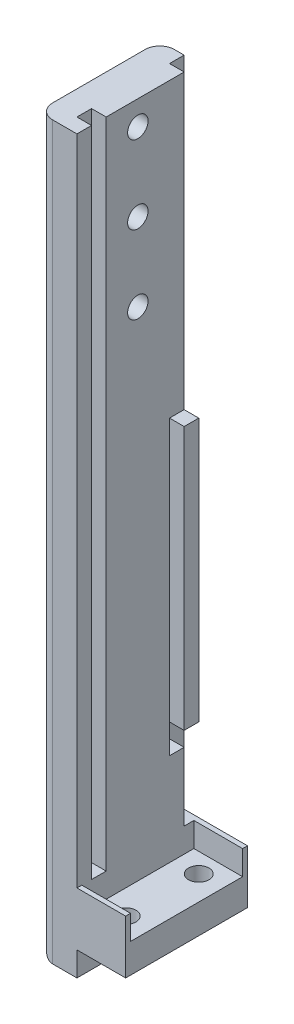
from build123d import *

# Parameters (mm, degrees)
EXTRUDE_1_DEPTH      = 25
SKETCH_2_R           = 2.1
CUT_EXTRUDE_1_DEPTH  = 25
SKETCH_3_R           = 2.1
CUT_EXTRUDE_2_DEPTH  = 25
SKETCH_4_W           = 10
SKETCH_4_H           = 1
EXTRUDE_2_DEPTH      = 5
SKETCH_5_W           = 3
SKETCH_5_H           = 3
CUT_EXTRUDE_3_DEPTH  = 134
FILLET_1_R           = 3
CUT_EXTRUDE_8_DEPTH  = 2
SKETCH_9_W           = 3
SKETCH_9_H           = 3
CUT_EXTRUDE_9_DEPTH  = 60
SKETCH_10_W          = 3
SKETCH_10_H          = 60
SKETCH_10_H_2        = 3
CUT_EXTRUDE_10_DEPTH = 3


with BuildPart() as part:
    # 草圖1 → 填料-伸長1 (new body)
    with BuildSketch(Plane.XY):
        Polygon((-18, 116.935334318), (-10, 116.935334318), (-10, -22.064665682), (0, -22.064665682), (0, -28.064665682), (-10, -28.064665682), (-10, -33.064665682), (-18, -33.064665682), align=None)
    extrude(amount=EXTRUDE_1_DEPTH)

    # 草圖2 → 除料-伸長1 (cut)
    with BuildSketch(Plane(origin=(0, -22.064665682, 0), x_dir=(1, 0, 0), z_dir=(0, 1, 0))):
        with Locations(Location((-5, -5, 0), (0, 0, 270))):
            Circle(SKETCH_2_R)
        with Locations(Location((-5, -20, 0), (0, 0, 270))):
            Circle(SKETCH_2_R)
    extrude(amount=-CUT_EXTRUDE_1_DEPTH, mode=Mode.SUBTRACT)

    # 草圖3 → 除料-伸長2 (cut)
    with BuildSketch(Plane.ZY.offset(18)):
        with Locations(Location((12.5, 111.935334318, 0), (0, 0, 270))):
            Circle(SKETCH_3_R)
        with Locations(Location((12.5, 95.935334318, 0), (0, 0, 270))):
            Circle(SKETCH_3_R)
        with Locations(Location((12.5, 79.935334318, 0), (0, 0, 270))):
            Circle(SKETCH_3_R)
    extrude(amount=-CUT_EXTRUDE_2_DEPTH, mode=Mode.SUBTRACT)

    # 草圖4 → 填料-伸長2 (add)
    with BuildSketch(Plane(origin=(0, -22.064665682, 0), x_dir=(1, 0, 0), z_dir=(0, 1, 0))):
        with Locations((-5, -0.5)):
            Rectangle(SKETCH_4_W, SKETCH_4_H)
        with Locations((-5, -24.5)):
            Rectangle(SKETCH_4_W, SKETCH_4_H)
    extrude(amount=EXTRUDE_2_DEPTH)

    # 草圖5 → 除料-伸長3 (cut)
    with BuildSketch(Plane(origin=(0, 116.935334318, 0), x_dir=(1, 0, 0), z_dir=(0, 1, 0))):
        with Locations((-11.5, -20.5)):
            Rectangle(SKETCH_5_W, SKETCH_5_H)
    extrude(amount=-CUT_EXTRUDE_3_DEPTH, mode=Mode.SUBTRACT)

    # 圓角1
    fillet_1_edges = [part.edges().sort_by_distance(p)[0] for p in [
        (-18, 41.935334318, 0),
        (-18, -33.064665682, 12.5),
        (-18, 41.935334318, 25),
    ]]
    fillet(fillet_1_edges, radius=FILLET_1_R)

    # 草圖8 → 除料-伸長8 (cut)
    # profile 1 of 15: a face of its own
    with BuildSketch(Plane.ZY.offset(18)):
        with BuildLine():
            add(Edge.make_bspline(
                [(17.856863064, 67.530636269), (17.855296332, 67.437651758), (17.852228302, 67.25556628), (17.82634662, 66.988838781), (17.78394367, 66.735480967), (17.726560707, 66.494175552), (17.649750771, 66.266820705), (17.557936101, 66.051239618), (17.44755783, 65.849490395), (17.360809416, 65.724692085), (17.317702032, 65.662676787)],
                knots=[0, 0, 0, 0, 1.12816708, 2.209215731, 3.248116935, 4.243547827, 5.21558058, 6.156596014, 7.083967991, 8, 8, 8, 8], degree=3))
            add(Edge.make_bspline(
                [(17.317702032, 65.662676787), (17.266839912, 65.598605549), (17.166966203, 65.472794195), (16.993132117, 65.309070469), (16.805649463, 65.168862), (16.601436573, 65.054950975), (16.381730967, 64.966560693), (16.14674453, 64.905335548), (15.897323183, 64.865564413), (15.725849285, 64.861150623), (15.637953619, 64.858888161)],
                knots=[0, 0, 0, 0, 1.012701384, 1.988557351, 2.949628104, 3.907511098, 4.877994277, 5.876267937, 6.911397907, 8, 8, 8, 8], degree=3))
            add(Edge.make_bspline(
                [(15.637953619, 64.858888161), (15.540234439, 64.860742371), (15.347635792, 64.864396908), (15.064726462, 64.894686996), (14.793102589, 64.943958358), (14.533176731, 65.013304527), (14.285218821, 65.102583865), (14.048271671, 65.210865899), (13.822484329, 65.338702411), (13.682759084, 65.44054161), (13.612915727, 65.491447168)],
                knots=[0, 0, 0, 0, 1.085307144, 2.13907533, 3.156586935, 4.149293442, 5.123911671, 6.080587554, 7.040558427, 8, 8, 8, 8], degree=3))
            add(Edge.make_bspline(
                [(13.612915727, 65.491447168), (13.53982604, 65.551219222), (13.396421663, 65.668493963), (13.208255401, 65.86822147), (13.050040439, 66.084038688), (12.918468838, 66.314211197), (12.817178687, 66.561127885), (12.747798555, 66.823389474), (12.701598239, 67.09975834), (12.696901849, 67.289400017), (12.694502315, 67.386293945)],
                knots=[0, 0, 0, 0, 1.03530484, 2.031302238, 3.001379119, 3.965721669, 4.933697138, 5.92066857, 6.93760384, 8, 8, 8, 8], degree=3))
            add(Edge.make_bspline(
                [(12.694502315, 67.386293945), (12.695228096, 67.453775604), (12.696650552, 67.586032625), (12.710418479, 67.779979887), (12.728567606, 67.965440264), (12.75980901, 68.141706595), (12.794822889, 68.310082813), (12.842550312, 68.468381963), (12.895697942, 68.61869416), (12.939087288, 68.713494003), (12.960545029, 68.760376261)],
                knots=[0, 0, 0, 0, 1.147323413, 2.248634334, 3.305431405, 4.314257543, 5.291331229, 6.227922242, 7.123637725, 8, 8, 8, 8], degree=3))
            add(Edge.make_bspline(
                [(12.960545029, 68.760376261), (12.990248803, 68.817361586), (13.047765017, 68.927703801), (13.155128292, 69.074704616), (13.274451273, 69.199335357), (13.406411293, 69.300759936), (13.549422498, 69.382560274), (13.707113809, 69.436251936), (13.875475749, 69.471936503), (13.991975, 69.475843027), (14.051603181, 69.477842516)],
                knots=[0, 0, 0, 0, 1.112393925, 2.153958177, 3.142559603, 4.092553007, 5.029478088, 5.983542709, 6.967910277, 8, 8, 8, 8], degree=3))
            add(Edge.make_bspline(
                [(14.051603181, 69.477842516), (14.094699861, 69.476464826), (14.180903585, 69.473709116), (14.30737878, 69.443362229), (14.430431636, 69.398185781), (14.549352821, 69.333665258), (14.662305112, 69.248427733), (14.773411421, 69.147711956), (14.879936398, 69.02766685), (14.944837706, 68.938329223), (14.978507317, 68.891982497)],
                knots=[0, 0, 0, 0, 0.903527792, 1.807272829, 2.716378173, 3.651771957, 4.636595936, 5.681576408, 6.797244253, 8, 8, 8, 8], degree=3))
            add(Edge.make_bspline(
                [(14.978507317, 68.891982497), (14.995329856, 68.867177688), (15.032094768, 68.812967881), (15.084572981, 68.720288724), (15.144996114, 68.612317858), (15.208831259, 68.486616846), (15.280726212, 68.34493303), (15.354353596, 68.185058559), (15.435655486, 68.009406453), (15.490469118, 67.886376477), (15.51908347, 67.822151157)],
                knots=[0, 0, 0, 0, 0.599209959, 1.309546742, 2.128759578, 3.073936344, 4.128726534, 5.306242828, 6.59377834, 8, 8, 8, 8], degree=3))
            Line((15.51908347, 67.822151157), (16.22664388, 66.217404148))
            add(Edge.make_bspline(
                [(16.22664388, 66.217404148), (16.263015694, 66.257160755), (16.335815145, 66.336734987), (16.427547919, 66.471361596), (16.506229429, 66.616772465), (16.569838948, 66.774943672), (16.619082902, 66.945215898), (16.654088501, 67.127100583), (16.675748702, 67.32067409), (16.678213848, 67.453689046), (16.679482542, 67.522145544)],
                knots=[0, 0, 0, 0, 0.911616805, 1.824632762, 2.750421705, 3.707297494, 4.705917279, 5.747825689, 6.840912551, 8, 8, 8, 8], degree=3))
            add(Edge.make_bspline(
                [(16.679482542, 67.522145544), (16.67651437, 67.625629133), (16.670793246, 67.825092776), (16.626517159, 68.11201123), (16.554055052, 68.375493444), (16.477571523, 68.534405031), (16.440327124, 68.611788575)],
                knots=[0, 0, 0, 0, 1.102054991, 2.124200604, 3.086561235, 4, 4, 4, 4], degree=3))
            add(Edge.make_bspline(
                [(16.440327124, 68.611788575), (16.407939708, 68.674449697), (16.347608921, 68.791173885), (16.281834769, 68.961526616), (16.235056542, 69.111214361), (16.229290695, 69.206340401), (16.22664388, 69.250008064)],
                knots=[0, 0, 0, 0, 1.245757543, 2.320578231, 3.229060482, 4, 4, 4, 4], degree=3))
            add(Edge.make_bspline(
                [(16.22664388, 69.250008064), (16.227616438, 69.289307078), (16.229440264, 69.363003993), (16.252879974, 69.465825184), (16.288904463, 69.554291233), (16.342130807, 69.627184073), (16.41160282, 69.682187797), (16.494230213, 69.723065595), (16.5930515, 69.74461643), (16.66335055, 69.747835182), (16.700709355, 69.749545713)],
                knots=[0, 0, 0, 0, 1.193249194, 2.237684269, 3.189262931, 4.081881314, 4.949225153, 5.860565448, 6.863046962, 8, 8, 8, 8], degree=3))
            add(Edge.make_bspline(
                [(16.700709355, 69.749545713), (16.744845454, 69.747064998), (16.832326939, 69.74214801), (16.95983746, 69.703265934), (17.080384538, 69.640039029), (17.192839938, 69.549773211), (17.299737534, 69.436349417), (17.400062278, 69.297803874), (17.493125961, 69.133999612), (17.547023539, 69.014177838), (17.575254021, 68.951417571)],
                knots=[0, 0, 0, 0, 0.841739181, 1.668398311, 2.522675029, 3.427382907, 4.408729894, 5.491669768, 6.686186419, 8, 8, 8, 8], degree=3))
            add(Edge.make_bspline(
                [(17.575254021, 68.951417571), (17.618828159, 68.839025948), (17.705870661, 68.614515523), (17.791219831, 68.261754361), (17.848190702, 67.899967523), (17.853955802, 67.654448315), (17.856863064, 67.530636269)],
                knots=[0, 0, 0, 0, 0.991353284, 1.980300145, 2.981492428, 4, 4, 4, 4], degree=3))
        make_face()
        with BuildLine():
            add(Edge.make_bspline(
                [(13.871882837, 67.382048582), (13.875211459, 67.31090312), (13.881731751, 67.171539383), (13.939407638, 66.971004544), (14.032487997, 66.786600439), (14.164972537, 66.620178748), (14.333044737, 66.470243559), (14.539577496, 66.339741077), (14.779230655, 66.219340761), (14.956401838, 66.158647726), (15.049263358, 66.126836416)],
                knots=[0, 0, 0, 0, 0.919251267, 1.800681113, 2.677170205, 3.577326367, 4.537145885, 5.578622746, 6.730872766, 8, 8, 8, 8], degree=3))
            add(Edge.make_bspline(
                [(15.049263358, 66.126836416), (14.97174714, 66.304602273), (14.817037548, 66.659393619), (14.664195515, 67.014993487), (14.587933971, 67.192422393)],
                knots=[0, 0, 0, 0, 1.002086777, 2, 2, 2, 2], degree=3))
            add(Edge.make_bspline(
                [(14.587933971, 67.192422393), (14.541523572, 67.293736584), (14.453023767, 67.486932213), (14.314777821, 67.757116879), (14.185399741, 67.996863601), (14.094297884, 68.141915827), (14.051603181, 68.209894262)],
                knots=[0, 0, 0, 0, 1.161508538, 2.214876008, 3.163405216, 4, 4, 4, 4], degree=3))
            add(Edge.make_bspline(
                [(14.051603181, 68.209894262), (14.023202536, 68.153602041), (13.964460186, 68.037170271), (13.912274318, 67.838726343), (13.877342061, 67.618700785), (13.873758268, 67.463346752), (13.871882837, 67.382048582)],
                knots=[0, 0, 0, 0, 0.881805604, 1.823878788, 2.861216098, 4, 4, 4, 4], degree=3))
        make_face(mode=Mode.SUBTRACT)
    # profile 2 of 15: a face of its own
    with BuildSketch(Plane.ZY.offset(18)):
        with BuildLine():
            add(Edge.make_bspline(
                [(12.909600679, 62.95696578), (12.777994338, 62.96025336), (12.525152408, 62.966569454), (12.161902899, 62.975872196), (11.830318855, 62.987649503), (11.53077263, 62.99870751), (11.262847704, 63.010182031), (11.026457919, 63.020880105), (10.821744209, 63.033622736), (10.695871394, 63.043169463), (10.638331764, 63.047533512)],
                knots=[0, 0, 0, 0, 1.389843129, 2.670164785, 3.836153771, 4.892654473, 5.834707703, 6.667312952, 7.390795233, 8, 8, 8, 8], degree=3))
            add(Edge.make_bspline(
                [(10.638331764, 63.047533512), (10.593649316, 63.055640331), (10.508370568, 63.07111261), (10.390987266, 63.114265855), (10.289411901, 63.16981797), (10.208952001, 63.244432748), (10.143990306, 63.331636817), (10.099579496, 63.434808804), (10.071780736, 63.552221615), (10.069327573, 63.635108239), (10.068038074, 63.678677398)],
                knots=[0, 0, 0, 0, 1.150302777, 2.195411926, 3.160410973, 4.067004535, 4.957574916, 5.900649542, 6.896481372, 8, 8, 8, 8], degree=3))
            add(Edge.make_bspline(
                [(10.068038074, 63.678677398), (10.069983698, 63.724666655), (10.073714161, 63.812844625), (10.108773948, 63.938460282), (10.16741828, 64.048902587), (10.247968162, 64.142966143), (10.34383616, 64.218986167), (10.451987635, 64.275915525), (10.571338856, 64.308873537), (10.654172394, 64.313252151), (10.696351718, 64.315481767)],
                knots=[0, 0, 0, 0, 1.100915838, 2.11085217, 3.097592046, 4.076651883, 5.058843049, 6.015027896, 6.989240548, 8, 8, 8, 8], degree=3))
            add(Edge.make_bspline(
                [(10.696351718, 64.315481767), (10.75767557, 64.315173729), (10.887883324, 64.314519679), (11.093559539, 64.309988986), (11.320927288, 64.302807875), (11.569053188, 64.292887325), (11.838867497, 64.279981293), (12.129445879, 64.264455845), (12.441714029, 64.245950683), (12.768088634, 64.224914826), (13.094463026, 64.203874324), (13.406731757, 64.185381888), (13.69777873, 64.169789231), (13.967599469, 64.157026832), (14.215719971, 64.146980235), (14.442617897, 64.139844909), (14.64829382, 64.135307168), (14.778501609, 64.134653948), (14.839825477, 64.134346302)],
                knots=[0, 0, 0, 0, 0.709619145, 1.506720675, 2.380498582, 3.34194485, 4.380212699, 5.506254792, 6.709207915, 8.000000872, 9.29079383, 10.493746952, 11.619789046, 12.663509261, 13.619501418, 14.493279325, 15.290380855, 16, 16, 16, 16], degree=3))
            add(Edge.make_bspline(
                [(14.839825477, 64.134346302), (14.97567901, 64.134546558), (15.235128878, 64.134929002), (15.606831448, 64.139732503), (15.943659209, 64.144751728), (16.245582215, 64.153069567), (16.512613475, 64.164167871), (16.744291235, 64.177937046), (16.941086169, 64.194358926), (17.060180544, 64.208587304), (17.113924634, 64.215008188)],
                knots=[0, 0, 0, 0, 1.432072131, 2.73493752, 3.918546012, 4.983066911, 5.91873213, 6.735727315, 7.429467723, 8, 8, 8, 8], degree=3))
            add(Edge.make_bspline(
                [(17.113924634, 64.215008188), (17.13842951, 64.217709066), (17.184532642, 64.22279046), (17.230889401, 64.224236567), (17.252606474, 64.224914034)],
                knots=[0, 0, 0, 0, 1.063046057, 2, 2, 2, 2], degree=3))
            add(Edge.make_bspline(
                [(17.252606474, 64.224914034), (17.294849412, 64.222981519), (17.377166126, 64.219215723), (17.494490553, 64.182633497), (17.598791865, 64.121364764), (17.688394476, 64.038792895), (17.763053705, 63.942262586), (17.817962529, 63.834921595), (17.849897107, 63.719154209), (17.854519061, 63.639716895), (17.856863064, 63.599430632)],
                knots=[0, 0, 0, 0, 1.046228165, 2.038732823, 3.014663236, 4.025912831, 5.044590737, 6.028982425, 7.000407653, 8, 8, 8, 8], degree=3))
            add(Edge.make_bspline(
                [(17.856863064, 63.599430632), (17.856423659, 63.571020642), (17.855574, 63.516085553), (17.838225083, 63.437053355), (17.815477986, 63.362384654), (17.778834166, 63.294579348), (17.735359076, 63.231213351), (17.679647758, 63.175243047), (17.614908324, 63.124468738), (17.566189727, 63.096030393), (17.541291121, 63.081496412)],
                knots=[0, 0, 0, 0, 1.061540286, 2.05265152, 3.019361935, 3.975680805, 4.926761327, 5.888939251, 6.921100501, 8, 8, 8, 8], degree=3))
            add(Edge.make_bspline(
                [(17.541291121, 63.081496412), (17.571979807, 63.028230058), (17.632835384, 62.922603025), (17.70600366, 62.757271404), (17.762379425, 62.588603882), (17.811171191, 62.359356085), (17.849454601, 62.06483653), (17.854367199, 61.826889101), (17.856863064, 61.705998976)],
                knots=[0, 0, 0, 0, 0.773143632, 1.533141669, 2.270837293, 3.006739634, 4.479262329, 6, 6, 6, 6], degree=3))
            add(Edge.make_bspline(
                [(17.856863064, 61.705998976), (17.855279321, 61.620032806), (17.852160786, 61.450757599), (17.81809952, 61.203189668), (17.766268648, 60.966133552), (17.692498009, 60.740405403), (17.597470929, 60.525417503), (17.480259984, 60.322760298), (17.34480015, 60.129046837), (17.23750309, 60.012827204), (17.183265554, 59.954079401)],
                knots=[0, 0, 0, 0, 1.070573951, 2.108057467, 3.107737416, 4.091039486, 5.062054769, 6.030986307, 7.004684276, 8, 8, 8, 8], degree=3))
            add(Edge.make_bspline(
                [(17.183265554, 59.954079401), (17.124997419, 59.897096941), (17.009886399, 59.784525823), (16.818426133, 59.640152123), (16.616377155, 59.516923626), (16.401339479, 59.418041094), (16.17520908, 59.340031231), (15.937530789, 59.28266071), (15.687431851, 59.250412519), (15.516814533, 59.245957423), (15.429930859, 59.24368875)],
                knots=[0, 0, 0, 0, 1.004288408, 1.984011695, 2.949817751, 3.91809124, 4.896881342, 5.895915506, 6.928534382, 8, 8, 8, 8], degree=3))
            add(Edge.make_bspline(
                [(15.429930859, 59.24368875), (15.326991291, 59.245722341), (15.125249008, 59.249707798), (14.830561535, 59.285033595), (14.550141455, 59.338573102), (14.286221823, 59.418933648), (14.03615426, 59.519001424), (13.802508063, 59.64443262), (13.582928158, 59.790595312), (13.381132227, 59.958828923), (13.199313817, 60.144924699), (13.038872732, 60.345733177), (12.904023216, 60.561337397), (12.795156555, 60.791222473), (12.707228023, 61.033382429), (12.64726864, 61.290360311), (12.611555636, 61.561120643), (12.606511683, 61.745983624), (12.603934582, 61.840435453)],
                knots=[0, 0, 0, 0, 1.144152062, 2.242323879, 3.295616719, 4.31441906, 5.304936721, 6.285728073, 7.257446177, 8.233190023, 9.201220917, 10.145662311, 11.085783033, 12.021812971, 12.969104506, 13.944848351, 14.949963743, 16, 16, 16, 16], degree=3))
            add(Edge.make_bspline(
                [(12.603934582, 61.840435453), (12.60439294, 61.898036717), (12.605288935, 62.010635465), (12.622582694, 62.173880531), (12.64340514, 62.328516754), (12.678396394, 62.472403806), (12.719734326, 62.608566639), (12.77471869, 62.733442396), (12.834034775, 62.851867763), (12.884586094, 62.922175178), (12.909600679, 62.95696578)],
                knots=[0, 0, 0, 0, 1.173140321, 2.293250583, 3.34278575, 4.350088541, 5.307776715, 6.238054731, 7.128127018, 8, 8, 8, 8], degree=3))
        make_face()
        with BuildLine():
            add(Edge.make_bspline(
                [(14.362929761, 62.866398048), (14.316444932, 62.840198271), (14.226021559, 62.789233855), (14.105543117, 62.69518674), (14.005606809, 62.587305419), (13.922500195, 62.469124847), (13.857990349, 62.339435103), (13.814829319, 62.197291112), (13.785034603, 62.04498512), (13.782574329, 61.938702227), (13.781315104, 61.884304199)],
                knots=[0, 0, 0, 0, 1.059966771, 2.061872076, 3.024053232, 3.973720071, 4.925838264, 5.889846059, 6.919974692, 8, 8, 8, 8], degree=3))
            add(Edge.make_bspline(
                [(13.781315104, 61.884304199), (13.782065148, 61.829041006), (13.783525634, 61.721432429), (13.804565998, 61.565327033), (13.834798877, 61.419781529), (13.877391057, 61.284169429), (13.933736685, 61.160308172), (14.002470431, 61.046627049), (14.083862931, 60.94405168), (14.177592848, 60.851370005), (14.284562673, 60.77076924), (14.403095295, 60.700654291), (14.534539204, 60.642994589), (14.678109219, 60.595024801), (14.833784631, 60.556936616), (15.001792213, 60.530311305), (15.181998642, 60.51501302), (15.306313754, 60.512786515), (15.370495784, 60.511637004)],
                knots=[0, 0, 0, 0, 1.102003739, 2.145823406, 3.1372671, 4.06609196, 4.976026107, 5.846187041, 6.71062653, 7.582618527, 8.46937274, 9.376673773, 10.324807452, 11.327979358, 12.394182482, 13.519263171, 14.719232735, 16, 16, 16, 16], degree=3))
            add(Edge.make_bspline(
                [(15.370495784, 60.511637004), (15.411587425, 60.512724839), (15.492714259, 60.514872541), (15.612398229, 60.53195526), (15.727516703, 60.562008994), (15.837773214, 60.603234406), (15.944043613, 60.654350639), (16.045096932, 60.718588392), (16.14063429, 60.795727208), (16.232638647, 60.880811095), (16.314368272, 60.975452364), (16.38946869, 61.072395395), (16.449887609, 61.175807105), (16.502096747, 61.28157574), (16.539327558, 61.392848491), (16.568408142, 61.50667276), (16.585662691, 61.624339233), (16.587825517, 61.704057617), (16.58891481, 61.744207238)],
                knots=[0, 0, 0, 0, 1.02622914, 2.026074414, 3.012075977, 3.992641093, 4.962313471, 5.952810932, 6.975991357, 8.02635778, 9.078309264, 10.096388209, 11.084570027, 12.064851906, 13.037455219, 14.009130168, 14.997311985, 16, 16, 16, 16], degree=3))
            add(Edge.make_bspline(
                [(16.58891481, 61.744207238), (16.587904324, 61.800398964), (16.586006299, 61.905945482), (16.570345209, 62.053012614), (16.54748271, 62.179814007), (16.518736547, 62.253490268), (16.505422682, 62.287613632)],
                knots=[0, 0, 0, 0, 1.21819942, 2.288178595, 3.207165163, 4, 4, 4, 4], degree=3))
            add(Edge.make_bspline(
                [(16.505422682, 62.287613632), (16.492632155, 62.312385923), (16.462482148, 62.370779513), (16.397922269, 62.465315175), (16.311468088, 62.58236735), (16.244833765, 62.667062183), (16.20824731, 62.713564999)],
                knots=[0, 0, 0, 0, 0.642578239, 1.514694416, 2.635410147, 4, 4, 4, 4], degree=3))
            add(Edge.make_bspline(
                [(16.20824731, 62.713564999), (16.18608009, 62.7399566), (16.140936781, 62.793702817), (16.08988715, 62.841878569), (16.063904986, 62.866398048)],
                knots=[0, 0, 0, 0, 0.982082181, 2, 2, 2, 2], degree=3))
            add(Edge.make_bspline(
                [(16.063904986, 62.866398048), (16.038907802, 62.865334803), (15.975731637, 62.862647632), (15.861068636, 62.861938773), (15.707296554, 62.862236493), (15.513893952, 62.862110822), (15.281815209, 62.862224034), (15.010110142, 62.861864244), (14.699724349, 62.863457226), (14.47944074, 62.865380697), (14.362929761, 62.866398048)],
                knots=[0, 0, 0, 0, 0.352980553, 0.892098794, 1.617523615, 2.522640823, 3.620760965, 4.891918221, 6.356093536, 8, 8, 8, 8], degree=3))
        make_face(mode=Mode.SUBTRACT)
    # profile 3 of 15: a face of its own
    with BuildSketch(Plane.ZY.offset(18)):
        with BuildLine():
            add(Edge.make_bspline(
                [(11.969960455, 57.842719138), (11.967785873, 57.791957896), (11.963527727, 57.692560073), (11.921534332, 57.548867445), (11.854339127, 57.416003059), (11.762668734, 57.296604458), (11.652949713, 57.196478838), (11.52747763, 57.123792963), (11.390612857, 57.077286466), (11.294377201, 57.072498821), (11.245418596, 57.070063171)],
                knots=[0, 0, 0, 0, 1.034247695, 2.025205903, 3.028861767, 4.059515193, 5.082579553, 6.040743336, 7.003254308, 8, 8, 8, 8], degree=3))
            add(Edge.make_bspline(
                [(11.245418596, 57.070063171), (11.19645999, 57.072498821), (11.100224335, 57.077286466), (10.963359561, 57.123792963), (10.837887478, 57.196478838), (10.728168457, 57.296604458), (10.636498064, 57.416003059), (10.569302859, 57.548867445), (10.527309464, 57.692560073), (10.523051319, 57.791957896), (10.520876736, 57.842719138)],
                knots=[0, 0, 0, 0, 0.996745692, 1.959256664, 2.917420447, 3.940484807, 4.971138233, 5.974794097, 6.965752305, 8, 8, 8, 8], degree=3))
            add(Edge.make_bspline(
                [(10.520876736, 57.842719138), (10.523088144, 57.8934616), (10.527418399, 57.992822645), (10.568651247, 58.135968028), (10.637064436, 58.266822785), (10.728028182, 58.384924796), (10.8388282, 58.482839691), (10.962587807, 58.558141105), (11.100581885, 58.601945154), (11.196531861, 58.607092194), (11.245418596, 58.609714623)],
                knots=[0, 0, 0, 0, 1.038045543, 2.032642637, 3.022766434, 4.049542068, 5.069926542, 6.036503862, 6.99959417, 8, 8, 8, 8], degree=3))
            add(Edge.make_bspline(
                [(11.245418596, 58.609714623), (11.294305331, 58.607092194), (11.390255307, 58.601945154), (11.528249384, 58.558141105), (11.652008992, 58.482839691), (11.76280901, 58.384924796), (11.853772755, 58.266822785), (11.922185945, 58.135968028), (11.963418792, 57.992822645), (11.967749047, 57.8934616), (11.969960455, 57.842719138)],
                knots=[0, 0, 0, 0, 1.00040583, 1.963496138, 2.930073458, 3.950457932, 4.977233566, 5.967357363, 6.961954457, 8, 8, 8, 8], degree=3))
        make_face()
    # profile 4 of 15: a face of its own
    with BuildSketch(Plane.ZY.offset(18)):
        with BuildLine():
            add(Edge.make_bspline(
                [(15.466724, 58.247443693), (15.51908347, 58.247443693), (15.637481912, 58.247443693), (15.836070534, 58.247443693), (16.075697659, 58.247443693), (16.343155494, 58.247443693), (16.610613329, 58.247443693), (16.850712162, 58.247443693), (17.049300783, 58.247443693), (17.167699225, 58.247443693), (17.220058695, 58.247443693)],
                knots=[0, 0, 0, 0, 0.716707022, 1.620661824, 2.718321227, 3.99677159, 5.281678773, 6.379338176, 7.283292978, 8, 8, 8, 8], degree=3))
            add(Edge.make_bspline(
                [(17.220058695, 58.247443693), (17.264709132, 58.245713846), (17.351429492, 58.242354127), (17.474077072, 58.203312515), (17.585320293, 58.142960009), (17.679839331, 58.057162356), (17.760341618, 57.956296522), (17.815848371, 57.837921454), (17.851053016, 57.707478888), (17.854885592, 57.615594664), (17.856863064, 57.568185699)],
                knots=[0, 0, 0, 0, 1.025026161, 1.99081232, 2.934276941, 3.919606467, 4.910670259, 5.88745613, 6.910003106, 8, 8, 8, 8], degree=3))
            add(Edge.make_bspline(
                [(17.856863064, 57.568185699), (17.854876799, 57.520784155), (17.85102718, 57.428914314), (17.815942525, 57.298370491), (17.759842532, 57.18002097), (17.680818913, 57.077800136), (17.584754447, 56.993570293), (17.474155324, 56.932976004), (17.351408321, 56.894039696), (17.264701936, 56.890665174), (17.220058695, 56.888927706)],
                knots=[0, 0, 0, 0, 1.089800183, 2.112162621, 3.088772214, 4.088254367, 5.066252605, 6.00954696, 6.975158825, 8, 8, 8, 8], degree=3))
            add(Edge.make_bspline(
                [(17.220058695, 56.888927706), (17.167699225, 56.888927706), (17.049300783, 56.888927706), (16.850712162, 56.888927706), (16.610613329, 56.888927706), (16.343155494, 56.888927706), (16.075697659, 56.888927706), (15.836070534, 56.888927706), (15.637481912, 56.888927706), (15.51908347, 56.888927706), (15.466724, 56.888927706)],
                knots=[0, 0, 0, 0, 0.716707022, 1.620661824, 2.718321227, 4.00322841, 5.281678773, 6.379338176, 7.283292978, 8, 8, 8, 8], degree=3))
            add(Edge.make_bspline(
                [(15.466724, 56.888927706), (15.391244099, 56.889534441), (15.231280233, 56.890820289), (14.977472393, 56.900063603), (14.696766912, 56.91402501), (14.398308148, 56.934218946), (14.100317295, 56.954338139), (13.820088723, 56.968402026), (13.566750183, 56.977597542), (13.406786499, 56.978887), (13.331306684, 56.979495439)],
                knots=[0, 0, 0, 0, 0.847393778, 1.7958739, 2.851067344, 4.002644545, 5.154221746, 6.2041261, 7.152606222, 8, 8, 8, 8], degree=3))
            add(Edge.make_bspline(
                [(13.331306684, 56.979495439), (13.286663443, 56.981232907), (13.199957058, 56.984607428), (13.077210055, 57.023543736), (12.966610932, 57.084138025), (12.870546466, 57.168367868), (12.791522847, 57.270588702), (12.735422854, 57.388938224), (12.700338199, 57.519482047), (12.69648858, 57.611351888), (12.694502315, 57.658753432)],
                knots=[0, 0, 0, 0, 1.024841175, 1.99045304, 2.933747395, 3.911745633, 4.911227786, 5.887837379, 6.910199817, 8, 8, 8, 8], degree=3))
            add(Edge.make_bspline(
                [(12.694502315, 57.658753432), (12.696479787, 57.706162397), (12.700312363, 57.79804662), (12.735517008, 57.928489187), (12.791023761, 58.046864255), (12.871526048, 58.147730089), (12.966045086, 58.233527742), (13.077288307, 58.293880247), (13.199935887, 58.332921859), (13.286656247, 58.336281579), (13.331306684, 58.338011425)],
                knots=[0, 0, 0, 0, 1.089996894, 2.11254387, 3.089329741, 4.080393533, 5.065723059, 6.00918768, 6.974973839, 8, 8, 8, 8], degree=3))
            add(Edge.make_bspline(
                [(13.331306684, 58.338011425), (13.406786499, 58.337402987), (13.566750183, 58.336113529), (13.820088723, 58.326918013), (14.100317295, 58.312854126), (14.398308148, 58.292734933), (14.696766912, 58.272540997), (14.977472393, 58.25857959), (15.231280233, 58.249336276), (15.391244099, 58.248050428), (15.466724, 58.247443693)],
                knots=[0, 0, 0, 0, 0.847393778, 1.7958739, 2.845778254, 3.997355455, 5.148932656, 6.2041261, 7.152606222, 8, 8, 8, 8], degree=3))
        make_face()
    # profile 5 of 15: a face of its own
    with BuildSketch(Plane.ZY.offset(18)):
        with BuildLine():
            add(Edge.make_bspline(
                [(14.143586034, 55.354936738), (14.14256232, 55.318537934), (14.140624029, 55.249620721), (14.124514668, 55.151873976), (14.100552551, 55.064752351), (14.062318017, 54.989839878), (14.016252163, 54.924311967), (13.955895557, 54.873304842), (13.887817729, 54.830521507), (13.836052115, 54.814203038), (13.809617521, 54.80586986)],
                knots=[0, 0, 0, 0, 1.251952787, 2.3704377, 3.403130822, 4.347127296, 5.253217272, 6.139151415, 7.049740304, 8, 8, 8, 8], degree=3))
            add(Edge.make_bspline(
                [(13.809617521, 54.80586986), (13.801362946, 54.73802528), (13.784665346, 54.600787236), (13.782440223, 54.462552178), (13.781315104, 54.392654581)],
                knots=[0, 0, 0, 0, 0.988713881, 2, 2, 2, 2], degree=3))
            add(Edge.make_bspline(
                [(13.781315104, 54.392654581), (13.781680648, 54.297334366), (13.78236166, 54.119751802), (13.798566602, 53.87239388), (13.820790094, 53.662658548), (13.8534764, 53.490592436), (13.89524508, 53.3545165), (13.948164069, 53.257115187), (14.012270612, 53.18688228), (14.066898517, 53.179248202), (14.092641684, 53.175650676)],
                knots=[0, 0, 0, 0, 1.722182638, 3.208444415, 4.478398308, 5.529983513, 6.373758216, 7.030382774, 7.543072012, 8, 8, 8, 8], degree=3))
            add(Edge.make_bspline(
                [(14.092641684, 53.175650676), (14.10905146, 53.178402647), (14.14592902, 53.184587129), (14.199128962, 53.221473366), (14.253935187, 53.278895695), (14.314254942, 53.356739951), (14.377523653, 53.457202378), (14.445041254, 53.578631894), (14.515468123, 53.722802786), (14.562724776, 53.826485909), (14.587933971, 53.881795965)],
                knots=[0, 0, 0, 0, 0.445852675, 1.001961217, 1.705991056, 2.597148059, 3.659384878, 4.916564488, 6.355132568, 8, 8, 8, 8], degree=3))
            add(Edge.make_bspline(
                [(14.587933971, 53.881795965), (14.622635844, 53.958778785), (14.689426116, 54.106946682), (14.788702808, 54.318426238), (14.879753479, 54.511826719), (14.968048349, 54.683754067), (15.048363241, 54.837538243), (15.123471395, 54.971196184), (15.190194236, 55.087280842), (15.237066875, 55.155192364), (15.25870124, 55.18653736)],
                knots=[0, 0, 0, 0, 1.379805456, 2.655694775, 3.817548463, 4.872380764, 5.813663794, 6.652164635, 7.377898001, 8, 8, 8, 8], degree=3))
            add(Edge.make_bspline(
                [(15.25870124, 55.18653736), (15.299655676, 55.242548466), (15.378671758, 55.35061437), (15.510046719, 55.494188578), (15.644066011, 55.616709614), (15.782790601, 55.717602752), (15.925853283, 55.795997112), (16.072914346, 55.851929363), (16.224145287, 55.886017816), (16.326472511, 55.89044875), (16.378061808, 55.892682649)],
                knots=[0, 0, 0, 0, 1.208274437, 2.331203187, 3.38446904, 4.36767125, 5.312933824, 6.218183972, 7.101679561, 8, 8, 8, 8], degree=3))
            add(Edge.make_bspline(
                [(16.378061808, 55.892682649), (16.443823728, 55.890871719), (16.572667217, 55.887323669), (16.759151621, 55.848803916), (16.934211541, 55.789448825), (17.096877404, 55.705649778), (17.245780034, 55.595801664), (17.38234904, 55.463038779), (17.5066189, 55.305746418), (17.576158981, 55.187913427), (17.612047162, 55.127102286)],
                knots=[0, 0, 0, 0, 1.028992223, 2.016044367, 2.969631151, 3.918307909, 4.87028952, 5.858116082, 6.894618525, 8, 8, 8, 8], degree=3))
            add(Edge.make_bspline(
                [(17.612047162, 55.127102286), (17.63936296, 55.074696351), (17.69466997, 54.968588681), (17.761804573, 54.799616739), (17.817793733, 54.621885226), (17.866636152, 54.436571223), (17.903179636, 54.242194762), (17.928130652, 54.038925437), (17.944032298, 53.826858075), (17.946284129, 53.682292654), (17.947430797, 53.608677647)],
                knots=[0, 0, 0, 0, 0.902364784, 1.827041616, 2.772818563, 3.7481142, 4.752991609, 5.791616483, 6.875456068, 8, 8, 8, 8], degree=3))
            add(Edge.make_bspline(
                [(17.947430797, 53.608677647), (17.944857224, 53.504796551), (17.939811781, 53.301139496), (17.903908344, 53.002303365), (17.844628977, 52.716611176), (17.783648019, 52.535038558), (17.753559244, 52.445448333)],
                knots=[0, 0, 0, 0, 1.051728971, 2.061896089, 3.043715037, 4, 4, 4, 4], degree=3))
            add(Edge.make_bspline(
                [(17.753559244, 52.445448333), (17.731052089, 52.388832757), (17.688184748, 52.281002196), (17.609802863, 52.133743897), (17.524449259, 52.008274259), (17.429593612, 51.905677134), (17.327651839, 51.82458001), (17.215719055, 51.768607605), (17.09677806, 51.732758102), (17.014176935, 51.728646065), (16.972412552, 51.726566957)],
                knots=[0, 0, 0, 0, 1.287322334, 2.451846262, 3.519729578, 4.486517876, 5.396218379, 6.257043452, 7.118734692, 8, 8, 8, 8], degree=3))
            add(Edge.make_bspline(
                [(16.972412552, 51.726566957), (16.934947996, 51.72783065), (16.864096463, 51.730220497), (16.765633471, 51.757732298), (16.681471548, 51.802245231), (16.61365962, 51.866824456), (16.559800467, 51.948344835), (16.524367899, 52.048328439), (16.501184585, 52.164661914), (16.499333312, 52.248142442), (16.498347078, 52.292615284)],
                knots=[0, 0, 0, 0, 1.062295321, 2.008972233, 2.878954203, 3.742194036, 4.642140348, 5.63080469, 6.73785116, 8, 8, 8, 8], degree=3))
            add(Edge.make_bspline(
                [(16.498347078, 52.292615284), (16.500302186, 52.333278763), (16.504628602, 52.423262046), (16.533039501, 52.569698773), (16.575035697, 52.740345924), (16.634499436, 52.925556475), (16.693023434, 53.111041396), (16.735796729, 53.282925341), (16.76366335, 53.430893033), (16.768067743, 53.522264923), (16.770050275, 53.56339378)],
                knots=[0, 0, 0, 0, 0.748522209, 1.656387712, 2.738796527, 3.982961709, 5.235430779, 6.317839594, 7.242815964, 8, 8, 8, 8], degree=3))
            add(Edge.make_bspline(
                [(16.770050275, 53.56339378), (16.769284008, 53.638917444), (16.767849352, 53.780318033), (16.749343592, 53.977530551), (16.72157923, 54.14534109), (16.680198747, 54.283616643), (16.625639926, 54.392771623), (16.558343251, 54.47300026), (16.476063709, 54.525832723), (16.414629359, 54.531377257), (16.383722291, 54.534166663)],
                knots=[0, 0, 0, 0, 1.589984138, 2.97687745, 4.167543443, 5.16671841, 6.006504429, 6.717691855, 7.354882334, 8, 8, 8, 8], degree=3))
            add(Edge.make_bspline(
                [(16.383722291, 54.534166663), (16.363022063, 54.532249453), (16.318731424, 54.528147351), (16.255741307, 54.490385202), (16.189489264, 54.438136771), (16.125959469, 54.360318552), (16.057483364, 54.265487625), (15.988495801, 54.14820916), (15.918512254, 54.009841988), (15.873819146, 53.909371143), (15.850221742, 53.85632379)],
                knots=[0, 0, 0, 0, 0.550202401, 1.177224488, 1.922772761, 2.809066119, 3.849956953, 5.056355524, 6.445792444, 8, 8, 8, 8], degree=3))
            add(Edge.make_bspline(
                [(15.850221742, 53.85632379), (15.815321256, 53.777546844), (15.7486048, 53.62695528), (15.653159265, 53.41175248), (15.563634139, 53.219672536), (15.483529802, 53.049345847), (15.409644777, 52.90180651), (15.343762, 52.775950123), (15.284862804, 52.6724773), (15.246181261, 52.612299809), (15.228983702, 52.585545294)],
                knots=[0, 0, 0, 0, 1.460599187, 2.7921102, 3.99061203, 5.052908019, 5.982674394, 6.787478554, 7.460920975, 8, 8, 8, 8], degree=3))
            add(Edge.make_bspline(
                [(15.228983702, 52.585545294), (15.189895967, 52.531912291), (15.113818273, 52.427524682), (14.986396112, 52.288820969), (14.852530944, 52.170880948), (14.711025077, 52.075467332), (14.563800804, 51.999034533), (14.408952407, 51.947372695), (14.24893362, 51.912349941), (14.13953084, 51.909264352), (14.08415096, 51.907702422)],
                knots=[0, 0, 0, 0, 1.147335881, 2.2330961, 3.250991195, 4.226462143, 5.178965424, 6.110545996, 7.043555044, 8, 8, 8, 8], degree=3))
            add(Edge.make_bspline(
                [(14.08415096, 51.907702422), (14.007437417, 51.910275365), (13.859439888, 51.915239145), (13.647076963, 51.965395926), (13.453520602, 52.045385138), (13.281093456, 52.161876806), (13.127589857, 52.307632481), (12.996764821, 52.487975271), (12.882399693, 52.697810038), (12.827664452, 52.853944686), (12.799221255, 52.935080137)],
                knots=[0, 0, 0, 0, 1.03382285, 1.994474795, 2.927489983, 3.845746262, 4.786958948, 5.770031034, 6.841195474, 8, 8, 8, 8], degree=3))
            add(Edge.make_bspline(
                [(12.799221255, 52.935080137), (12.783476164, 52.988686396), (12.750437627, 53.101170488), (12.711918188, 53.281911477), (12.67735859, 53.481961476), (12.652473889, 53.701818152), (12.627966409, 53.940804943), (12.616176447, 54.199652742), (12.604817087, 54.477934747), (12.604234893, 54.670003165), (12.603934582, 54.769076719)],
                knots=[0, 0, 0, 0, 0.724304811, 1.519836873, 2.394756855, 3.356080144, 4.388407309, 5.509511304, 6.71534547, 8, 8, 8, 8], degree=3))
            add(Edge.make_bspline(
                [(12.603934582, 54.769076719), (12.60489766, 54.844176554), (12.606701801, 54.984861597), (12.629723307, 55.179761267), (12.662612981, 55.345854968), (12.703864389, 55.440333479), (12.722804731, 55.483712732)],
                knots=[0, 0, 0, 0, 1.233178176, 2.310121214, 3.224102072, 4, 4, 4, 4], degree=3))
            add(Edge.make_bspline(
                [(12.722804731, 55.483712732), (12.736473562, 55.509358733), (12.76325421, 55.559605641), (12.819247454, 55.623078592), (12.880157932, 55.679970024), (12.951302018, 55.725088013), (13.030936789, 55.75887501), (13.118032475, 55.785276246), (13.214416386, 55.798227792), (13.28127777, 55.800792817), (13.315740355, 55.802114917)],
                knots=[0, 0, 0, 0, 0.976229491, 1.912676912, 2.835665217, 3.779506997, 4.733604609, 5.744812642, 6.837601334, 8, 8, 8, 8], degree=3))
            add(Edge.make_bspline(
                [(13.315740355, 55.802114917), (13.380444657, 55.800996835), (13.501759014, 55.79890054), (13.670423755, 55.777649966), (13.81498157, 55.745476078), (13.933318265, 55.696356721), (14.029029243, 55.634328214), (14.094380316, 55.552985063), (14.137667704, 55.458897771), (14.141571015, 55.390332449), (14.143586034, 55.354936738)],
                knots=[0, 0, 0, 0, 1.475920378, 2.767209063, 3.874378373, 4.844153005, 5.680302601, 6.445368786, 7.197447381, 8, 8, 8, 8], degree=3))
        make_face()
    # profile 6 of 15: a face of its own
    with BuildSketch(Plane.ZY.offset(18)):
        with BuildLine():
            add(Edge.make_bspline(
                [(18.037998529, 46.333541514), (18.036687491, 46.285754737), (18.034197227, 46.194985726), (18.006957275, 46.066645512), (17.962197122, 45.954914067), (17.898252165, 45.859091019), (17.814598779, 45.782476729), (17.713973371, 45.721207698), (17.594898828, 45.679049746), (17.508584785, 45.665574035), (17.463459476, 45.658528883)],
                knots=[0, 0, 0, 0, 1.15639667, 2.196527799, 3.160122028, 4.057232829, 4.962966061, 5.886197827, 6.894896229, 8, 8, 8, 8], degree=3))
            add(Edge.make_bspline(
                [(17.463459476, 45.658528883), (17.300249731, 45.648608897), (16.972890284, 45.628711794), (16.645520508, 45.608985351), (16.481365628, 45.599093808)],
                knots=[0, 0, 0, 0, 0.997128672, 2, 2, 2, 2], degree=3))
            add(Edge.make_bspline(
                [(16.481365628, 45.599093808), (16.312531087, 45.590377822), (15.985370095, 45.573488323), (15.657797447, 45.569763664), (15.499271779, 45.56796115)],
                knots=[0, 0, 0, 0, 1.032119017, 2, 2, 2, 2], degree=3))
            add(Edge.make_bspline(
                [(15.499271779, 45.56796115), (15.475214725, 45.56796115), (15.419553306, 45.56796115), (15.324740211, 45.56796115), (15.20775689, 45.56796115), (15.076150654, 45.56796115), (14.945016125, 45.56796115), (14.828504511, 45.56796115), (14.734163123, 45.56796115), (14.678501704, 45.56796115), (14.65444465, 45.56796115)],
                knots=[0, 0, 0, 0, 0.683417085, 1.581239531, 2.693467337, 4.006700168, 5.319932998, 6.418760469, 7.316582915, 8, 8, 8, 8], degree=3))
            add(Edge.make_bspline(
                [(14.65444465, 45.56796115), (14.646897339, 45.56796115), (14.627557354, 45.56796115), (14.591707627, 45.56796115), (14.543121812, 45.56796115), (14.465761874, 45.56796115), (14.371892193, 45.56796115), (14.29830591, 45.56796115), (14.265286424, 45.56796115)],
                knots=[0, 0, 0, 0, 0.349090909, 0.894545455, 1.658181818, 2.596363636, 4.472727273, 6, 6, 6, 6], degree=3))
            add(Edge.make_bspline(
                [(14.265286424, 45.56796115), (14.234613441, 45.567544502), (14.176853357, 45.566759914), (14.096392397, 45.557841005), (14.028994638, 45.53993027), (13.971712685, 45.520170503), (13.927253088, 45.490088928), (13.893983327, 45.453655088), (13.874578984, 45.409282688), (13.872795224, 45.377572937), (13.871882837, 45.361353511)],
                knots=[0, 0, 0, 0, 1.484606759, 2.795652719, 3.903050259, 4.856976313, 5.711780415, 6.472033802, 7.218450667, 8, 8, 8, 8], degree=3))
            add(Edge.make_bspline(
                [(13.871882837, 45.361353511), (13.873640802, 45.324438143), (13.877170751, 45.250313017), (13.902313482, 45.139614443), (13.944265798, 45.030177096), (14.001438858, 44.920331111), (14.075498533, 44.81114046), (14.167335847, 44.703811147), (14.273506242, 44.596192497), (14.395236594, 44.490441284), (14.529847221, 44.389095095), (14.67336025, 44.290510751), (14.825911441, 44.19867907), (14.988223785, 44.114235261), (15.157873006, 44.033349992), (15.336492968, 43.957788116), (15.52467582, 43.890867443), (15.653406631, 43.849654281), (15.718615506, 43.828777663)],
                knots=[0, 0, 0, 0, 0.698025825, 1.401618223, 2.1357772, 2.909997275, 3.739039499, 4.625579534, 5.578303856, 6.596468352, 7.672568379, 8.763985104, 9.888704182, 11.038173789, 12.223548973, 13.443218942, 14.704856945, 16, 16, 16, 16], degree=3))
            add(Edge.make_bspline(
                [(15.718615506, 43.828777663), (15.747859147, 43.826400635), (15.810602082, 43.821300664), (15.911242376, 43.81353365), (16.024808823, 43.799963853), (16.104948014, 43.790122046), (16.147397114, 43.784908918)],
                knots=[0, 0, 0, 0, 0.816748744, 1.752354084, 2.809439597, 4, 4, 4, 4], degree=3))
            add(Edge.make_bspline(
                [(16.147397114, 43.784908918), (16.2194908, 43.776654611), (16.361497699, 43.760395649), (16.504406407, 43.757856555), (16.574763602, 43.756606501)],
                knots=[0, 0, 0, 0, 1.015354688, 2, 2, 2, 2], degree=3))
            add(Edge.make_bspline(
                [(16.574763602, 43.756606501), (16.600235777, 43.756606501), (16.657312316, 43.756606501), (16.751181997, 43.756606501), (16.862504835, 43.756606501), (16.985148639, 43.756606501), (17.108264151, 43.756606501), (17.219586989, 43.756606501), (17.313928377, 43.756606501), (17.371004916, 43.756606501), (17.396948798, 43.756606501)],
                knots=[0, 0, 0, 0, 0.743545611, 1.666092943, 2.74010327, 3.993115318, 5.246127367, 6.333907057, 7.242685026, 8, 8, 8, 8], degree=3))
            add(Edge.make_bspline(
                [(17.396948798, 43.756606501), (17.441056949, 43.754632348), (17.52748545, 43.750764059), (17.650659754, 43.714555688), (17.761184242, 43.654317255), (17.858782648, 43.574378936), (17.937416501, 43.474800027), (17.997475505, 43.362699806), (18.03200437, 43.236424052), (18.035957515, 43.148312697), (18.037998529, 43.102820683)],
                knots=[0, 0, 0, 0, 1.032701104, 2.023544552, 2.978917315, 3.969081109, 4.960850609, 5.93575385, 6.934226857, 8, 8, 8, 8], degree=3))
            add(Edge.make_bspline(
                [(18.037998529, 43.102820683), (18.035964005, 43.057780256), (18.032003508, 42.9701025), (17.997062901, 42.844832329), (17.939543276, 42.731993876), (17.860035832, 42.634566927), (17.763249866, 42.554842961), (17.652952315, 42.495621228), (17.529682526, 42.460738084), (17.443870644, 42.456746362), (17.39977904, 42.454695348)],
                knots=[0, 0, 0, 0, 1.060614024, 2.064639789, 3.039838215, 4.028460469, 5.008469718, 5.978961007, 6.961555787, 8, 8, 8, 8], degree=3))
            add(Edge.make_bspline(
                [(17.39977904, 42.454695348), (17.374297499, 42.454466841), (17.317620058, 42.453958584), (17.223793786, 42.447125009), (17.112835656, 42.439398835), (16.990809123, 42.426392931), (16.86878259, 42.413387027), (16.757824459, 42.405660854), (16.663998187, 42.398827278), (16.607320746, 42.398319021), (16.581839206, 42.398090515)],
                knots=[0, 0, 0, 0, 0.745452016, 1.658075322, 2.751597369, 4, 5.248402631, 6.341924678, 7.254547984, 8, 8, 8, 8], degree=3))
            add(Edge.make_bspline(
                [(16.581839206, 42.398090515), (16.541273675, 42.398627053), (16.456369564, 42.399750034), (16.323309224, 42.400174594), (16.179018324, 42.405784417), (16.023279833, 42.408663449), (15.855912042, 42.417238343), (15.677029392, 42.422833356), (15.487044373, 42.434224412), (15.289771383, 42.442635558), (15.092742981, 42.455402719), (14.903000303, 42.462433784), (14.724796108, 42.472396257), (14.55772193, 42.476657022), (14.401657965, 42.483805393), (14.256784652, 42.485249996), (14.123321393, 42.489396347), (14.038398206, 42.488896862), (13.99782859, 42.488658247)],
                knots=[0, 0, 0, 0, 0.753058446, 1.576159773, 2.469647947, 3.433155257, 4.467278767, 5.580139743, 6.755030365, 7.999878182, 9.245187813, 10.41965421, 11.524147952, 12.557937796, 13.521723559, 14.42375143, 15.246992459, 16, 16, 16, 16], degree=3))
            add(Edge.make_bspline(
                [(13.99782859, 42.488658247), (13.970941294, 42.488658247), (13.911034513, 42.488658247), (13.811976055, 42.488658247), (13.694521027, 42.488658247), (13.565273326, 42.488658247), (13.436497331, 42.488658247), (13.320457424, 42.488658247), (13.222814087, 42.488658247), (13.16385072, 42.488658247), (13.137435131, 42.488658247)],
                knots=[0, 0, 0, 0, 0.75, 1.671052632, 2.763157895, 4.026315789, 5.276315789, 6.355263158, 7.263157895, 8, 8, 8, 8], degree=3))
            add(Edge.make_bspline(
                [(13.137435131, 42.488658247), (13.094284304, 42.490710476), (13.010321197, 42.494703713), (12.889775717, 42.529572298), (12.782128239, 42.589253889), (12.687429758, 42.6684655), (12.609314787, 42.764272529), (12.553345566, 42.873776697), (12.519764138, 42.993788963), (12.51553306, 43.07713234), (12.51336685, 43.119802133)],
                knots=[0, 0, 0, 0, 1.04414341, 2.031699764, 3.008682333, 4.0067659, 5.006418988, 5.982799617, 6.96724221, 8, 8, 8, 8], degree=3))
            add(Edge.make_bspline(
                [(12.51336685, 43.119802133), (12.515213532, 43.166280709), (12.518760303, 43.255548319), (12.554773368, 43.380779082), (12.61393978, 43.489065637), (12.697279019, 43.578866693), (12.803465057, 43.651254729), (12.933855252, 43.701794175), (13.085485585, 43.739687538), (13.195194326, 43.747964277), (13.253475039, 43.752361139)],
                knots=[0, 0, 0, 0, 1.013300018, 1.946162677, 2.81799956, 3.685929579, 4.597778473, 5.600595704, 6.725361425, 8, 8, 8, 8], degree=3))
            Line((13.253475039, 43.752361139), (13.305834509, 43.756606501))
            add(Edge.make_bspline(
                [(13.305834509, 43.756606501), (13.250217813, 43.817147486), (13.141798332, 43.935166402), (12.998000407, 44.121072108), (12.87712795, 44.310213991), (12.776841256, 44.501531768), (12.700487276, 44.696323315), (12.644271579, 44.892766271), (12.610832876, 45.092280182), (12.606235893, 45.226323731), (12.603934582, 45.293427711)],
                knots=[0, 0, 0, 0, 1.138458514, 2.21931705, 3.250692209, 4.244347634, 5.206568234, 6.143610746, 7.070666891, 8, 8, 8, 8], degree=3))
            add(Edge.make_bspline(
                [(12.603934582, 45.293427711), (12.605877105, 45.369039197), (12.609639643, 45.515493619), (12.64504171, 45.725965253), (12.704993875, 45.918149061), (12.786787713, 46.092301618), (12.893365793, 46.248539373), (13.025163446, 46.384587347), (13.179292404, 46.504209614), (13.295811134, 46.565452705), (13.355363738, 46.596753986)],
                knots=[0, 0, 0, 0, 1.135868455, 2.200101703, 3.195780642, 4.153577706, 5.081841206, 6.024613901, 6.990382182, 8, 8, 8, 8], degree=3))
            add(Edge.make_bspline(
                [(13.355363738, 46.596753986), (13.39984189, 46.616492304), (13.492354509, 46.657547145), (13.64321437, 46.703908913), (13.808463711, 46.745356283), (13.98944275, 46.779067179), (14.18653823, 46.803817146), (14.398508167, 46.821927188), (14.626018021, 46.833394504), (14.782734806, 46.835051444), (14.863882531, 46.835909405)],
                knots=[0, 0, 0, 0, 0.758518815, 1.577686083, 2.457567908, 3.415897309, 4.447299157, 5.555243819, 6.734108786, 8, 8, 8, 8], degree=3))
            Line((14.863882531, 46.835909405), (15.202096407, 46.835909405))
            add(Edge.make_bspline(
                [(15.202096407, 46.835909405), (15.236059355, 46.835437595), (15.298325959, 46.834572593), (15.383708157, 46.833387888), (15.453036614, 46.831371989), (15.494082069, 46.831575265), (15.512007866, 46.831664042)],
                knots=[0, 0, 0, 0, 1.315042326, 2.410957427, 3.306016816, 4, 4, 4, 4], degree=3))
            add(Edge.make_bspline(
                [(15.512007866, 46.831664042), (15.578072094, 46.832942622), (15.719819462, 46.835685942), (15.945553968, 46.853476215), (16.197799556, 46.884300196), (16.467356276, 46.923136567), (16.736477577, 46.964991336), (16.988429319, 46.995010842), (17.213187855, 47.013054107), (17.353996528, 47.015776617), (17.419590731, 47.017044869)],
                knots=[0, 0, 0, 0, 0.826546788, 1.773438313, 2.831190141, 4.005469484, 5.180593797, 6.238345625, 7.179352285, 8, 8, 8, 8], degree=3))
            add(Edge.make_bspline(
                [(17.419590731, 47.017044869), (17.462339705, 47.014665968), (17.545745961, 47.010024564), (17.66459425, 46.971479659), (17.772260269, 46.90937205), (17.864613899, 46.821917432), (17.941890613, 46.718736299), (17.998994274, 46.600804555), (18.03142308, 46.470645951), (18.035773031, 46.379945298), (18.037998529, 46.333541514)],
                knots=[0, 0, 0, 0, 0.996381484, 1.944010417, 2.886824946, 3.876852983, 4.892534291, 5.882868714, 6.916844591, 8, 8, 8, 8], degree=3))
        make_face()
    # profile 7 of 15: a face of its own
    with BuildSketch(Plane.ZY.offset(18)):
        with BuildLine():
            add(Edge.make_bspline(
                [(13.448761712, 41.919779678), (13.753232691, 41.832322368), (14.349569663, 41.66102845), (15.220347813, 41.397147529), (16.048168948, 41.131076857), (16.583520909, 40.947916685), (16.845051678, 40.858439063)],
                knots=[0, 0, 0, 0, 1.068169217, 2.09211662, 3.067958569, 4, 4, 4, 4], degree=3))
            add(Edge.make_bspline(
                [(16.845051678, 40.858439063), (16.917699374, 40.832248154), (17.06641594, 40.778632937), (17.286041401, 40.673532961), (17.509094123, 40.547742777), (17.653780435, 40.449156044), (17.72808707, 40.398524797)],
                knots=[0, 0, 0, 0, 0.927093937, 1.897847217, 2.920396153, 4, 4, 4, 4], degree=3))
            add(Edge.make_bspline(
                [(17.72808707, 40.398524797), (17.753073109, 40.379249055), (17.801847718, 40.341621372), (17.865826596, 40.27733772), (17.920133137, 40.209098003), (17.964865439, 40.136098795), (17.998583828, 40.057858521), (18.023273667, 39.975315385), (18.035567281, 39.887570311), (18.03717371, 39.827791721), (18.037998529, 39.797098449)],
                knots=[0, 0, 0, 0, 1.072569902, 2.093736345, 3.076092147, 4.033762363, 4.996661027, 5.966487109, 6.955894339, 8, 8, 8, 8], degree=3))
            add(Edge.make_bspline(
                [(18.037998529, 39.797098449), (18.033924521, 39.748445766), (18.025750263, 39.650827003), (17.966055548, 39.510388001), (17.871358585, 39.380743075), (17.742370955, 39.259285832), (17.578074768, 39.148180869), (17.379742142, 39.043533111), (17.145451885, 38.948510085), (16.975655203, 38.894459673), (16.886090182, 38.865948949)],
                knots=[0, 0, 0, 0, 0.738481601, 1.481720144, 2.283852359, 3.166598287, 4.161443282, 5.290943496, 6.57101623, 8, 8, 8, 8], degree=3))
            add(Edge.make_bspline(
                [(16.886090182, 38.865948949), (16.845587903, 38.854848284), (16.757411691, 38.830681381), (16.612419598, 38.79716937), (16.444395647, 38.762129092), (16.252875952, 38.7252223), (16.037562092, 38.687701306), (15.799144683, 38.645963426), (15.53669078, 38.60547814), (15.354002088, 38.578566738), (15.25870124, 38.564528215)],
                knots=[0, 0, 0, 0, 0.608590973, 1.324943903, 2.15623135, 3.096102377, 4.151497852, 5.323731836, 6.603905786, 8, 8, 8, 8], degree=3))
            add(Edge.make_bspline(
                [(15.25870124, 38.564528215), (15.290722814, 38.549318713), (15.348874846, 38.521697853), (15.428009686, 38.485988469), (15.490097669, 38.460688353), (15.525671557, 38.447032226), (15.540310283, 38.441412704)],
                knots=[0, 0, 0, 0, 1.383646751, 2.512739323, 3.38798929, 4, 4, 4, 4], degree=3))
            add(Edge.make_bspline(
                [(15.540310283, 38.441412704), (15.593102414, 38.419618127), (15.705566613, 38.373188678), (15.885024605, 38.301527246), (16.084873187, 38.221884814), (16.304958177, 38.136245178), (16.545479994, 38.042253148), (16.805982011, 37.940392415), (17.087937427, 37.833267332), (17.28232658, 37.759330717), (17.38279759, 37.721116206)],
                knots=[0, 0, 0, 0, 0.692867068, 1.476029457, 2.344204492, 3.302729726, 4.340958493, 5.476964536, 6.695956449, 8, 8, 8, 8], degree=3))
            add(Edge.make_bspline(
                [(17.38279759, 37.721116206), (17.414647282, 37.708002773), (17.476963156, 37.682345537), (17.564044069, 37.635279361), (17.639002821, 37.575758782), (17.681459616, 37.530155878), (17.702614895, 37.507432963)],
                knots=[0, 0, 0, 0, 1.062588452, 2.079019366, 3.042817955, 4, 4, 4, 4], degree=3))
            add(Edge.make_bspline(
                [(17.702614895, 37.507432963), (17.728085137, 37.490120429), (17.778434865, 37.455896909), (17.844744864, 37.394674322), (17.901971574, 37.327818393), (17.94948417, 37.254726208), (17.986254079, 37.175025373), (18.012923214, 37.088823416), (18.031939351, 36.996872674), (18.035949483, 36.932988726), (18.037998529, 36.900346131)],
                knots=[0, 0, 0, 0, 1.019770702, 2.015888869, 2.980962225, 3.930840647, 4.896293978, 5.880434831, 6.916971966, 8, 8, 8, 8], degree=3))
            add(Edge.make_bspline(
                [(18.037998529, 36.900346131), (18.037418865, 36.880901366), (18.03623683, 36.841250116), (18.018191886, 36.781623083), (17.985276965, 36.723671127), (17.942562033, 36.66258958), (17.883835748, 36.603363683), (17.813613223, 36.541613106), (17.730235433, 36.47972928), (17.668466008, 36.440941558), (17.636104216, 36.420620173)],
                knots=[0, 0, 0, 0, 0.713131145, 1.454198165, 2.26134956, 3.156700228, 4.187355441, 5.318245839, 6.594994672, 8, 8, 8, 8], degree=3))
            add(Edge.make_bspline(
                [(17.636104216, 36.420620173), (17.562237364, 36.379666471), (17.408474921, 36.294416578), (17.154147368, 36.187978999), (16.870593693, 36.093318239), (16.669486131, 36.042391042), (16.564857756, 36.015895619)],
                knots=[0, 0, 0, 0, 0.881320092, 1.834570267, 2.873411859, 4, 4, 4, 4], degree=3))
            add(Edge.make_bspline(
                [(16.564857756, 36.015895619), (16.538452081, 36.0097234), (16.481955075, 35.996517454), (16.391550604, 35.976314128), (16.289688269, 35.957758718), (16.17786096, 35.933819258), (16.05448848, 35.912006692), (15.920098569, 35.887705772), (15.774765098, 35.862494025), (15.618664694, 35.835405158), (15.451655122, 35.807250405), (15.273945995, 35.777230027), (15.085124173, 35.747891494), (14.885611178, 35.716640789), (14.674753192, 35.684121255), (14.453029077, 35.650301375), (14.220500955, 35.614768863), (14.061984809, 35.590860804), (13.98084714, 35.578623286)],
                knots=[0, 0, 0, 0, 0.49657932, 1.062470276, 1.696039445, 2.392280022, 3.156370997, 3.989996542, 4.893172921, 5.857400048, 6.891196538, 7.99457132, 9.157630462, 10.390295574, 11.692570309, 13.064457763, 14.497420847, 16, 16, 16, 16], degree=3))
            add(Edge.make_bspline(
                [(13.98084714, 35.578623286), (13.912973505, 35.568791463), (13.785449067, 35.550318934), (13.605190875, 35.53024775), (13.448448618, 35.518329186), (13.351605637, 35.516006627), (13.30724963, 35.514942849)],
                knots=[0, 0, 0, 0, 1.215348776, 2.283459124, 3.213790212, 4, 4, 4, 4], degree=3))
            add(Edge.make_bspline(
                [(13.30724963, 35.514942849), (13.264937709, 35.5166837), (13.182344387, 35.520081859), (13.065073746, 35.559709982), (12.957894796, 35.619584743), (12.86564639, 35.703754536), (12.78861651, 35.803470014), (12.735328196, 35.916785681), (12.700588647, 36.038867458), (12.696570321, 36.123670305), (12.694502315, 36.167313547)],
                knots=[0, 0, 0, 0, 1.014937161, 1.98116819, 2.947599467, 3.953086831, 4.966242952, 5.96193177, 6.951121243, 8, 8, 8, 8], degree=3))
            add(Edge.make_bspline(
                [(12.694502315, 36.167313547), (12.696092477, 36.20707656), (12.699153164, 36.283610987), (12.72354181, 36.392184871), (12.762736907, 36.489534166), (12.821272238, 36.572473861), (12.893460248, 36.645811199), (12.983725183, 36.704239382), (13.089179247, 36.752057004), (13.166284088, 36.772274035), (13.206776051, 36.782891103)],
                knots=[0, 0, 0, 0, 1.086101446, 2.090489252, 3.027004632, 3.935665688, 4.847615694, 5.824126378, 6.857329917, 8, 8, 8, 8], degree=3))
            add(Edge.make_bspline(
                [(13.206776051, 36.782891103), (13.25389708, 36.793033935), (13.353030204, 36.814372403), (13.510004712, 36.842988239), (13.683005194, 36.866074042), (13.803466563, 36.880233503), (13.866222353, 36.887610044)],
                knots=[0, 0, 0, 0, 0.865747489, 1.821357782, 2.865010291, 4, 4, 4, 4], degree=3))
            add(Edge.make_bspline(
                [(13.866222353, 36.887610044), (13.911017984, 36.892491562), (13.995382993, 36.901685078), (14.114900552, 36.912208346), (14.219550507, 36.923744182), (14.309993809, 36.934396941), (14.386153343, 36.940328788), (14.447369669, 36.947959653), (14.494091647, 36.953429939), (14.520482671, 36.956928293), (14.531329138, 36.958366085)],
                knots=[0, 0, 0, 0, 1.616753821, 3.04488288, 4.304627006, 5.39428379, 6.312140678, 7.044817162, 7.607428654, 8, 8, 8, 8], degree=3))
            add(Edge.make_bspline(
                [(14.531329138, 36.958366085), (14.564804326, 36.964124545), (14.636876446, 36.976522518), (14.752639431, 36.994193242), (14.883111202, 37.016139162), (15.028005424, 37.03829244), (15.187961157, 37.062506395), (15.362540084, 37.089092811), (15.552025362, 37.119247572), (15.683223853, 37.139117837), (15.751163285, 37.149407395)],
                knots=[0, 0, 0, 0, 0.660222282, 1.421459364, 2.276133763, 3.231853736, 4.27052925, 5.420738271, 6.664362861, 8, 8, 8, 8], degree=3))
            add(Edge.make_bspline(
                [(15.751163285, 37.149407395), (15.667203629, 37.179136045), (15.494647208, 37.240235264), (15.228499458, 37.334227499), (14.9465335, 37.429904119), (14.650048379, 37.530559475), (14.338650157, 37.63366482), (14.012803605, 37.740132433), (13.671489374, 37.848735969), (13.438860889, 37.922551334), (13.319985717, 37.960271625)],
                knots=[0, 0, 0, 0, 0.834031914, 1.71412758, 2.643026698, 3.622193373, 4.646049676, 5.71462549, 6.832153824, 8, 8, 8, 8], degree=3))
            add(Edge.make_bspline(
                [(13.319985717, 37.960271625), (13.270451598, 37.977484087), (13.176238666, 38.010221856), (13.047657447, 38.076054887), (12.939253657, 38.15386562), (12.850142902, 38.242904262), (12.778401729, 38.341366325), (12.730656512, 38.453241468), (12.699538313, 38.575106418), (12.696215937, 38.660553241), (12.694502315, 38.704625176)],
                knots=[0, 0, 0, 0, 1.19694291, 2.276562153, 3.287523764, 4.232400904, 5.144381951, 6.05144731, 6.994971549, 8, 8, 8, 8], degree=3))
            add(Edge.make_bspline(
                [(12.694502315, 38.704625176), (12.696555345, 38.747796805), (12.70052237, 38.831216415), (12.73483187, 38.95029734), (12.788510465, 39.058566445), (12.867642063, 39.153806356), (12.968400814, 39.235648825), (13.08948169, 39.30710316), (13.232464315, 39.36655157), (13.337038572, 39.394581509), (13.392156879, 39.409355344)],
                knots=[0, 0, 0, 0, 0.956714578, 1.848639009, 2.72917723, 3.622269142, 4.574329265, 5.598110799, 6.734028138, 8, 8, 8, 8], degree=3))
            add(Edge.make_bspline(
                [(13.392156879, 39.409355344), (13.479792274, 39.430559542), (13.667244667, 39.475915389), (13.968072731, 39.538344301), (14.305467749, 39.603398859), (14.542597697, 39.645961137), (14.667180737, 39.668322454)],
                knots=[0, 0, 0, 0, 0.831405566, 1.778379195, 2.832807599, 4, 4, 4, 4], degree=3))
            add(Edge.make_bspline(
                [(14.667180737, 39.668322454), (14.757275556, 39.68436734), (14.927995639, 39.714770691), (15.169890475, 39.757741646), (15.383550189, 39.792957024), (15.566943396, 39.828702387), (15.722635534, 39.854231915), (15.848781207, 39.878843061), (15.946445182, 39.897125128), (16.001639838, 39.907476805), (16.024281603, 39.911723235)],
                knots=[0, 0, 0, 0, 1.592929315, 3.018431325, 4.276517255, 5.361967755, 6.270447383, 7.022492858, 7.599010319, 8, 8, 8, 8], degree=3))
            add(Edge.make_bspline(
                [(16.024281603, 39.911723235), (16.014869014, 39.914631067), (15.989165811, 39.92257156), (15.939699486, 39.934292883), (15.87007938, 39.953402272), (15.779867235, 39.977029291), (15.669094865, 40.007039057), (15.538106843, 40.042499795), (15.386002922, 40.081784094), (15.214069125, 40.127512743), (15.021100113, 40.176024956), (14.808950425, 40.233934185), (14.575143612, 40.294070829), (14.320877708, 40.360520214), (14.046561809, 40.433051949), (13.75156145, 40.509237281), (13.436433804, 40.591209398), (13.219503757, 40.648025637), (13.107717594, 40.677303598)],
                knots=[0, 0, 0, 0, 0.156787591, 0.428143966, 0.808802003, 1.306027329, 1.912566285, 2.635672323, 3.466163321, 4.413220571, 5.467687366, 6.633360972, 7.913687767, 9.310580208, 10.816775336, 12.430373555, 14.160536772, 16, 16, 16, 16], degree=3))
            add(Edge.make_bspline(
                [(13.107717594, 40.677303598), (13.075262399, 40.686623028), (13.012138966, 40.704748768), (12.926222762, 40.748763237), (12.854182444, 40.806594046), (12.795024954, 40.875691123), (12.749413564, 40.95648982), (12.716309588, 41.048699211), (12.698862553, 41.153550786), (12.696004512, 41.227254765), (12.694502315, 41.265993859)],
                knots=[0, 0, 0, 0, 1.030258276, 2.003791335, 2.92681449, 3.836800741, 4.766553194, 5.746892772, 6.815758212, 8, 8, 8, 8], degree=3))
            add(Edge.make_bspline(
                [(12.694502315, 41.265993859), (12.696743256, 41.309585592), (12.701167912, 41.395655849), (12.734538264, 41.520762909), (12.79103591, 41.636808844), (12.866597953, 41.742214744), (12.959181357, 41.831364737), (13.065501424, 41.898627981), (13.184745336, 41.93826005), (13.267809762, 41.942893809), (13.310079871, 41.945251853)],
                knots=[0, 0, 0, 0, 1.027775917, 2.029305374, 3.029844932, 4.058403916, 5.0738736, 6.04360831, 7.004424697, 8, 8, 8, 8], degree=3))
            add(Edge.make_bspline(
                [(13.310079871, 41.945251853), (13.329998092, 41.943985746), (13.377167976, 41.94098738), (13.422545535, 41.927545509), (13.448761712, 41.919779678)],
                knots=[0, 0, 0, 0, 0.844531233, 2, 2, 2, 2], degree=3))
        make_face()
    # profile 8 of 15: a face of its own
    with BuildSketch(Plane.ZY.offset(18)):
        with BuildLine():
            add(Edge.make_bspline(
                [(17.947430797, 32.643662706), (17.945480397, 32.569981979), (17.941627537, 32.424431544), (17.912467375, 32.210353854), (17.866395451, 32.003929355), (17.799151508, 31.805823745), (17.712646079, 31.615815396), (17.606701199, 31.433935588), (17.484184029, 31.258242562), (17.387758497, 31.151161325), (17.338928844, 31.09693565)],
                knots=[0, 0, 0, 0, 1.037398836, 2.049299145, 3.037210619, 4.011990128, 4.990091719, 5.972313262, 6.973184416, 8, 8, 8, 8], degree=3))
            add(Edge.make_bspline(
                [(17.338928844, 31.09693565), (17.282055808, 31.040015444), (17.169317012, 30.927183142), (16.980314065, 30.780492736), (16.777409523, 30.655811178), (16.560436086, 30.55222768), (16.330516175, 30.467627193), (16.085804547, 30.408489923), (15.828064497, 30.365275048), (15.650871481, 30.356881077), (15.560121974, 30.352582099)],
                knots=[0, 0, 0, 0, 0.974094293, 1.930936437, 2.890505312, 3.854149817, 4.83944518, 5.852652743, 6.900234847, 8, 8, 8, 8], degree=3))
            add(Edge.make_bspline(
                [(15.560121974, 30.352582099), (15.473286796, 30.35154373), (15.301170485, 30.349485574), (15.046365667, 30.372853059), (14.798882812, 30.4168902), (14.558483106, 30.481021497), (14.324859732, 30.564221109), (14.098548762, 30.66836596), (13.879214634, 30.792677814), (13.741786581, 30.891395212), (13.672350801, 30.94127236)],
                knots=[0, 0, 0, 0, 1.032972863, 2.047459122, 3.039659377, 4.021466136, 5.005197002, 5.987388884, 6.983124484, 8, 8, 8, 8], degree=3))
            add(Edge.make_bspline(
                [(13.672350801, 30.94127236), (13.594240083, 31.004025622), (13.440588369, 31.127467658), (13.241812347, 31.342818136), (13.071872198, 31.574058144), (12.93361636, 31.824424944), (12.825185781, 32.092247483), (12.749182269, 32.378882839), (12.703307838, 32.683219212), (12.697480878, 32.892089779), (12.694502315, 32.998858032)],
                knots=[0, 0, 0, 0, 1.014645645, 1.995910997, 2.961078346, 3.917963704, 4.887740904, 5.883088111, 6.917899312, 8, 8, 8, 8], degree=3))
            add(Edge.make_bspline(
                [(12.694502315, 32.998858032), (12.69625811, 33.078277954), (12.699685502, 33.233309286), (12.738750252, 33.458976609), (12.797036458, 33.673353809), (12.882783, 33.874521547), (12.99101881, 34.063601616), (13.124616752, 34.238552649), (13.280359246, 34.403039586), (13.40034375, 34.498397773), (13.461497799, 34.547000208)],
                knots=[0, 0, 0, 0, 1.060035486, 2.069237928, 3.050986958, 4.02256805, 4.982550458, 5.954417699, 6.957401709, 8, 8, 8, 8], degree=3))
            add(Edge.make_bspline(
                [(13.461497799, 34.547000208), (13.520229432, 34.588199647), (13.637773998, 34.670655554), (13.827361256, 34.774758097), (14.025749052, 34.864745335), (14.235362636, 34.936677001), (14.454805052, 34.993615799), (14.684951265, 35.032403074), (14.925132708, 35.057228702), (15.088823506, 35.060456546), (15.17237887, 35.062104187)],
                knots=[0, 0, 0, 0, 0.946431446, 1.894173002, 2.850143192, 3.819025814, 4.815820488, 5.839539401, 6.897200863, 8, 8, 8, 8], degree=3))
            add(Edge.make_bspline(
                [(15.17237887, 35.062104187), (15.263492476, 35.060155233), (15.442863186, 35.056318428), (15.706368978, 35.027433464), (15.959503118, 34.980870695), (16.202565396, 34.915950297), (16.435766419, 34.831020992), (16.657756193, 34.72502251), (16.872178245, 34.604783462), (17.003998639, 34.507841728), (17.070055889, 34.459262718)],
                knots=[0, 0, 0, 0, 1.078100348, 2.122401166, 3.132990041, 4.121505959, 5.096356088, 6.065258288, 7.03047083, 8, 8, 8, 8], degree=3))
            add(Edge.make_bspline(
                [(17.070055889, 34.459262718), (17.139782392, 34.401758589), (17.27650117, 34.289005275), (17.456166433, 34.097212088), (17.609376451, 33.891278447), (17.732233353, 33.668880936), (17.830345724, 33.433360376), (17.897171689, 33.18249112), (17.939500021, 32.917743249), (17.944750754, 32.736282605), (17.947430797, 32.643662706)],
                knots=[0, 0, 0, 0, 1.035104406, 2.029618642, 3.003968802, 3.969745099, 4.934673453, 5.921041118, 6.938872043, 8, 8, 8, 8], degree=3))
        make_face()
        with BuildLine():
            add(Edge.make_bspline(
                [(13.962450569, 32.962064891), (13.963389679, 32.9128774), (13.965236356, 32.816154471), (13.992261921, 32.675635886), (14.032674034, 32.542555393), (14.091473224, 32.418280741), (14.167526652, 32.301971684), (14.261705027, 32.194920245), (14.371618655, 32.094374539), (14.454656394, 32.036582991), (14.497366239, 32.006858337)],
                knots=[0, 0, 0, 0, 1.028264754, 2.021993364, 2.984056079, 3.933875716, 4.889836492, 5.883908554, 6.911604053, 8, 8, 8, 8], degree=3))
            add(Edge.make_bspline(
                [(14.497366239, 32.006858337), (14.535661071, 31.983060541), (14.61196429, 31.935642957), (14.733262127, 31.876757747), (14.85837894, 31.825301682), (14.988778721, 31.782598345), (15.124204832, 31.750349509), (15.264254461, 31.727998919), (15.408849262, 31.713030872), (15.507251975, 31.711749626), (15.557291733, 31.711098086)],
                knots=[0, 0, 0, 0, 0.968900899, 1.930554389, 2.89493204, 3.876439545, 4.877715631, 5.884882381, 6.924420164, 8, 8, 8, 8], degree=3))
            add(Edge.make_bspline(
                [(15.557291733, 31.711098086), (15.603562452, 31.712246812), (15.694012438, 31.714492341), (15.825186518, 31.730105902), (15.948486999, 31.755453668), (16.063298373, 31.791480102), (16.168595291, 31.841064369), (16.267350209, 31.897071286), (16.357654516, 31.965309715), (16.409862354, 32.019344699), (16.436081761, 32.04648172)],
                knots=[0, 0, 0, 0, 1.14553638, 2.23929414, 3.26548939, 4.259064347, 5.210202514, 6.141705064, 7.066741829, 8, 8, 8, 8], degree=3))
            add(Edge.make_bspline(
                [(16.436081761, 32.04648172), (16.473318638, 32.091438796), (16.546451548, 32.179734112), (16.623088802, 32.332635411), (16.670742253, 32.496000096), (16.676536333, 32.608897753), (16.679482542, 32.666304639)],
                knots=[0, 0, 0, 0, 1.025581715, 2.014233798, 2.990265544, 4, 4, 4, 4], degree=3))
            add(Edge.make_bspline(
                [(16.679482542, 32.666304639), (16.676733819, 32.736080566), (16.67135341, 32.872661439), (16.613485815, 33.068654599), (16.52702673, 33.252503001), (16.441291295, 33.357490726), (16.397873499, 33.41065819)],
                knots=[0, 0, 0, 0, 1.025967648, 2.008250728, 2.991346294, 4, 4, 4, 4], degree=3))
            add(Edge.make_bspline(
                [(16.397873499, 33.41065819), (16.369748726, 33.439665649), (16.314005065, 33.497158803), (16.219184896, 33.570722194), (16.118289845, 33.634714622), (16.010112511, 33.689408649), (15.893782, 33.730810213), (15.77096688, 33.764294618), (15.64045896, 33.785100427), (15.550753516, 33.791094288), (15.504932262, 33.794155932)],
                knots=[0, 0, 0, 0, 0.970239318, 1.923026744, 2.87621895, 3.839742348, 4.82985614, 5.839325873, 6.896334581, 8, 8, 8, 8], degree=3))
            add(Edge.make_bspline(
                [(15.504932262, 33.794155932), (15.442669395, 33.796270778), (15.322386585, 33.800356353), (15.147733438, 33.794914435), (14.985165955, 33.786348841), (14.834277799, 33.768187581), (14.696063411, 33.740843716), (14.568781989, 33.709233756), (14.454139121, 33.668285422), (14.351341354, 33.619878283), (14.259620093, 33.565288852), (14.181211025, 33.500678444), (14.114000509, 33.429465066), (14.057646214, 33.350981107), (14.015103725, 33.263801655), (13.985690673, 33.169233061), (13.96681779, 33.067990658), (13.963932142, 32.998000039), (13.962450569, 32.962064891)],
                knots=[0, 0, 0, 0, 1.50667455, 2.910676263, 4.225399364, 5.444055087, 6.583181806, 7.632148603, 8.613914468, 9.522525522, 10.377760785, 11.188682773, 11.971747628, 12.741140401, 13.516853941, 14.307201737, 15.130869841, 16, 16, 16, 16], degree=3))
        make_face(mode=Mode.SUBTRACT)
    # profile 9 of 15: a face of its own
    with BuildSketch(Plane.ZY.offset(18)):
        with BuildLine():
            add(Edge.make_bspline(
                [(12.909600679, 28.450659718), (12.777994338, 28.453947298), (12.525152408, 28.460263393), (12.161902899, 28.469566134), (11.830318855, 28.481343441), (11.53077263, 28.492401448), (11.262847704, 28.503875969), (11.026457919, 28.514574043), (10.821744209, 28.527316674), (10.695871394, 28.536863401), (10.638331764, 28.541227451)],
                knots=[0, 0, 0, 0, 1.389843129, 2.670164785, 3.836153771, 4.892654473, 5.834707703, 6.667312952, 7.390795233, 8, 8, 8, 8], degree=3))
            add(Edge.make_bspline(
                [(10.638331764, 28.541227451), (10.593649316, 28.549334269), (10.508370568, 28.564806548), (10.390987266, 28.607959793), (10.289411901, 28.663511908), (10.208952001, 28.738126687), (10.143990306, 28.825330755), (10.099579496, 28.928502742), (10.071780736, 29.045915553), (10.069327573, 29.128802177), (10.068038074, 29.172371336)],
                knots=[0, 0, 0, 0, 1.150302777, 2.195411926, 3.160410973, 4.067004535, 4.957574916, 5.900649542, 6.896481372, 8, 8, 8, 8], degree=3))
            add(Edge.make_bspline(
                [(10.068038074, 29.172371336), (10.069983698, 29.218360593), (10.073714161, 29.306538563), (10.108773948, 29.43215422), (10.16741828, 29.542596525), (10.247968162, 29.636660081), (10.34383616, 29.712680105), (10.451987635, 29.769609463), (10.571338856, 29.802567475), (10.654172394, 29.806946089), (10.696351718, 29.809175705)],
                knots=[0, 0, 0, 0, 1.100915838, 2.11085217, 3.097592046, 4.076651883, 5.058843049, 6.015027896, 6.989240548, 8, 8, 8, 8], degree=3))
            add(Edge.make_bspline(
                [(10.696351718, 29.809175705), (10.75767557, 29.808867667), (10.887883324, 29.808213617), (11.093559539, 29.803682924), (11.320927288, 29.796501813), (11.569053188, 29.786581263), (11.838867497, 29.773675231), (12.129445879, 29.758149783), (12.441714029, 29.739644621), (12.768088634, 29.718608765), (13.094463026, 29.697568262), (13.406731757, 29.679075826), (13.69777873, 29.663483169), (13.967599469, 29.65072077), (14.215719971, 29.640674174), (14.442617897, 29.633538847), (14.64829382, 29.629001106), (14.778501609, 29.628347886), (14.839825477, 29.62804024)],
                knots=[0, 0, 0, 0, 0.709619145, 1.506720675, 2.380498582, 3.34194485, 4.380212699, 5.506254792, 6.709207915, 8.000000872, 9.29079383, 10.493746952, 11.619789046, 12.663509261, 13.619501418, 14.493279325, 15.290380855, 16, 16, 16, 16], degree=3))
            add(Edge.make_bspline(
                [(14.839825477, 29.62804024), (14.97567901, 29.628240496), (15.235128878, 29.62862294), (15.606831448, 29.633426441), (15.943659209, 29.638445666), (16.245582215, 29.646763505), (16.512613475, 29.657861809), (16.744291235, 29.671630984), (16.941086169, 29.688052864), (17.060180544, 29.702281242), (17.113924634, 29.708702127)],
                knots=[0, 0, 0, 0, 1.432072131, 2.73493752, 3.918546012, 4.983066911, 5.91873213, 6.735727315, 7.429467723, 8, 8, 8, 8], degree=3))
            add(Edge.make_bspline(
                [(17.113924634, 29.708702127), (17.13842951, 29.711403004), (17.184532642, 29.716484398), (17.230889401, 29.717930505), (17.252606474, 29.718607972)],
                knots=[0, 0, 0, 0, 1.063046057, 2, 2, 2, 2], degree=3))
            add(Edge.make_bspline(
                [(17.252606474, 29.718607972), (17.294849412, 29.716675457), (17.377166126, 29.712909661), (17.494490553, 29.676327435), (17.598791865, 29.615058702), (17.688394476, 29.532486833), (17.763053705, 29.435956524), (17.817962529, 29.328615533), (17.849897107, 29.212848148), (17.854519061, 29.133410833), (17.856863064, 29.09312457)],
                knots=[0, 0, 0, 0, 1.046228165, 2.038732823, 3.014663236, 4.025912831, 5.044590737, 6.028982425, 7.000407653, 8, 8, 8, 8], degree=3))
            add(Edge.make_bspline(
                [(17.856863064, 29.09312457), (17.856423659, 29.06471458), (17.855574, 29.009779491), (17.838225083, 28.930747293), (17.815477986, 28.856078592), (17.778834166, 28.788273286), (17.735359076, 28.724907289), (17.679647758, 28.668936985), (17.614908324, 28.618162676), (17.566189727, 28.589724331), (17.541291121, 28.57519035)],
                knots=[0, 0, 0, 0, 1.061540286, 2.05265152, 3.019361935, 3.975680805, 4.926761327, 5.888939251, 6.921100501, 8, 8, 8, 8], degree=3))
            add(Edge.make_bspline(
                [(17.541291121, 28.57519035), (17.571979807, 28.521923996), (17.632835384, 28.416296963), (17.70600366, 28.250965342), (17.762379425, 28.08229782), (17.811171191, 27.853050023), (17.849454601, 27.558530468), (17.854367199, 27.320583039), (17.856863064, 27.199692914)],
                knots=[0, 0, 0, 0, 0.773143632, 1.533141669, 2.270837293, 3.006739634, 4.479262329, 6, 6, 6, 6], degree=3))
            add(Edge.make_bspline(
                [(17.856863064, 27.199692914), (17.855279321, 27.113726744), (17.852160786, 26.944451537), (17.81809952, 26.696883606), (17.766268648, 26.45982749), (17.692498009, 26.234099341), (17.597470929, 26.019111441), (17.480259984, 25.816454236), (17.34480015, 25.622740775), (17.23750309, 25.506521142), (17.183265554, 25.447773339)],
                knots=[0, 0, 0, 0, 1.070573951, 2.108057467, 3.107737416, 4.091039486, 5.062054769, 6.030986307, 7.004684276, 8, 8, 8, 8], degree=3))
            add(Edge.make_bspline(
                [(17.183265554, 25.447773339), (17.124997419, 25.390790879), (17.009886399, 25.278219761), (16.818426133, 25.133846061), (16.616377155, 25.010617564), (16.401339479, 24.911735032), (16.17520908, 24.833725169), (15.937530789, 24.776354648), (15.687431851, 24.744106457), (15.516814533, 24.739651362), (15.429930859, 24.737382688)],
                knots=[0, 0, 0, 0, 1.004288408, 1.984011695, 2.949817751, 3.91809124, 4.896881342, 5.895915506, 6.928534382, 8, 8, 8, 8], degree=3))
            add(Edge.make_bspline(
                [(15.429930859, 24.737382688), (15.326991291, 24.739416279), (15.125249008, 24.743401736), (14.830561535, 24.778727533), (14.550141455, 24.83226704), (14.286221823, 24.912627586), (14.03615426, 25.012695362), (13.802508063, 25.138126558), (13.582928158, 25.28428925), (13.381132227, 25.452522862), (13.199313817, 25.638618637), (13.038872732, 25.839427115), (12.904023216, 26.055031335), (12.795156555, 26.284916411), (12.707228023, 26.527076367), (12.64726864, 26.784054249), (12.611555636, 27.054814581), (12.606511683, 27.239677562), (12.603934582, 27.334129392)],
                knots=[0, 0, 0, 0, 1.144152062, 2.242323879, 3.295616719, 4.31441906, 5.304936721, 6.285728073, 7.257446177, 8.233190023, 9.201220917, 10.145662311, 11.085783033, 12.021812971, 12.969104506, 13.944848351, 14.949963743, 16, 16, 16, 16], degree=3))
            add(Edge.make_bspline(
                [(12.603934582, 27.334129392), (12.60439294, 27.391730655), (12.605288935, 27.504329403), (12.622582694, 27.66757447), (12.64340514, 27.822210692), (12.678396394, 27.966097744), (12.719734326, 28.102260577), (12.77471869, 28.227136334), (12.834034775, 28.345561701), (12.884586094, 28.415869116), (12.909600679, 28.450659718)],
                knots=[0, 0, 0, 0, 1.173140321, 2.293250583, 3.34278575, 4.350088541, 5.307776715, 6.238054731, 7.128127018, 8, 8, 8, 8], degree=3))
        make_face()
        with BuildLine():
            add(Edge.make_bspline(
                [(14.362929761, 28.360091986), (14.316444932, 28.333892209), (14.226021559, 28.282927793), (14.105543117, 28.188880678), (14.005606809, 28.080999357), (13.922500195, 27.962818785), (13.857990349, 27.833129041), (13.814829319, 27.690985051), (13.785034603, 27.538679058), (13.782574329, 27.432396165), (13.781315104, 27.377998137)],
                knots=[0, 0, 0, 0, 1.059966771, 2.061872076, 3.024053232, 3.973720071, 4.925838264, 5.889846059, 6.919974692, 8, 8, 8, 8], degree=3))
            add(Edge.make_bspline(
                [(13.781315104, 27.377998137), (13.782065148, 27.322734944), (13.783525634, 27.215126367), (13.804565998, 27.059020971), (13.834798877, 26.913475467), (13.877391057, 26.777863367), (13.933736685, 26.65400211), (14.002470431, 26.540320987), (14.083862931, 26.437745618), (14.177592848, 26.345063943), (14.284562673, 26.264463178), (14.403095295, 26.194348229), (14.534539204, 26.136688527), (14.678109219, 26.088718739), (14.833784631, 26.050630554), (15.001792213, 26.024005243), (15.181998642, 26.008706958), (15.306313754, 26.006480453), (15.370495784, 26.005330942)],
                knots=[0, 0, 0, 0, 1.102003739, 2.145823406, 3.1372671, 4.06609196, 4.976026107, 5.846187041, 6.71062653, 7.582618527, 8.46937274, 9.376673773, 10.324807452, 11.327979358, 12.394182482, 13.519263171, 14.719232735, 16, 16, 16, 16], degree=3))
            add(Edge.make_bspline(
                [(15.370495784, 26.005330942), (15.411587425, 26.006418777), (15.492714259, 26.008566479), (15.612398229, 26.025649198), (15.727516703, 26.055702932), (15.837773214, 26.096928344), (15.944043613, 26.148044577), (16.045096932, 26.21228233), (16.14063429, 26.289421146), (16.232638647, 26.374505033), (16.314368272, 26.469146302), (16.38946869, 26.566089333), (16.449887609, 26.669501043), (16.502096747, 26.775269678), (16.539327558, 26.886542429), (16.568408142, 27.000366698), (16.585662691, 27.118033171), (16.587825517, 27.197751555), (16.58891481, 27.237901176)],
                knots=[0, 0, 0, 0, 1.02622914, 2.026074414, 3.012075977, 3.992641093, 4.962313471, 5.952810932, 6.975991357, 8.02635778, 9.078309264, 10.096388209, 11.084570027, 12.064851906, 13.037455219, 14.009130168, 14.997311985, 16, 16, 16, 16], degree=3))
            add(Edge.make_bspline(
                [(16.58891481, 27.237901176), (16.587904324, 27.294092902), (16.586006299, 27.39963942), (16.570345209, 27.546706552), (16.54748271, 27.673507945), (16.518736547, 27.747184206), (16.505422682, 27.78130757)],
                knots=[0, 0, 0, 0, 1.21819942, 2.288178595, 3.207165163, 4, 4, 4, 4], degree=3))
            add(Edge.make_bspline(
                [(16.505422682, 27.78130757), (16.492632155, 27.806079861), (16.462482148, 27.864473451), (16.397922269, 27.959009113), (16.311468088, 28.076061288), (16.244833765, 28.160756121), (16.20824731, 28.207258937)],
                knots=[0, 0, 0, 0, 0.642578239, 1.514694416, 2.635410147, 4, 4, 4, 4], degree=3))
            add(Edge.make_bspline(
                [(16.20824731, 28.207258937), (16.18608009, 28.233650538), (16.140936781, 28.287396755), (16.08988715, 28.335572507), (16.063904986, 28.360091986)],
                knots=[0, 0, 0, 0, 0.982082181, 2, 2, 2, 2], degree=3))
            add(Edge.make_bspline(
                [(16.063904986, 28.360091986), (16.038907802, 28.359028741), (15.975731637, 28.35634157), (15.861068636, 28.355632711), (15.707296554, 28.355930431), (15.513893952, 28.35580476), (15.281815209, 28.355917972), (15.010110142, 28.355558182), (14.699724349, 28.357151164), (14.47944074, 28.359074636), (14.362929761, 28.360091986)],
                knots=[0, 0, 0, 0, 0.352980553, 0.892098794, 1.617523615, 2.522640823, 3.620760965, 4.891918221, 6.356093536, 8, 8, 8, 8], degree=3))
        make_face(mode=Mode.SUBTRACT)
    # profile 10 of 15: a face of its own
    with BuildSketch(Plane.ZY.offset(18)):
        with BuildLine():
            add(Edge.make_bspline(
                [(13.849240904, 19.531153193), (13.849027152, 19.493881189), (13.848561558, 19.412694968), (13.842210407, 19.288222204), (13.835740196, 19.163754724), (13.835295188, 19.083039093), (13.835089695, 19.045766752)],
                knots=[0, 0, 0, 0, 0.920858442, 2.00582231, 3.079141558, 4, 4, 4, 4], degree=3))
            add(Edge.make_bspline(
                [(13.835089695, 19.045766752), (13.837343628, 18.973043574), (13.842185779, 18.816811517), (13.861538471, 18.661691405), (13.871882837, 18.578776881)],
                knots=[0, 0, 0, 0, 0.930963592, 2, 2, 2, 2], degree=3))
            add(Edge.make_bspline(
                [(13.871882837, 18.578776881), (14.023762388, 18.585629156), (14.313809726, 18.598715077), (14.728508786, 18.61353381), (15.102104337, 18.627564599), (15.434121938, 18.64118367), (15.72472463, 18.649551118), (15.973806707, 18.654747706), (16.181812622, 18.659824197), (16.306831857, 18.660536668), (16.362495479, 18.660853889)],
                knots=[0, 0, 0, 0, 1.464153678, 2.796122796, 3.996273984, 5.06460741, 5.99627393, 6.796007809, 7.463933961, 8, 8, 8, 8], degree=3))
            add(Edge.make_bspline(
                [(16.362495479, 18.660853889), (16.374761003, 18.660774186), (16.404016111, 18.660584081), (16.45447157, 18.6626036), (16.518157054, 18.663761298), (16.61580272, 18.665536089), (16.731833708, 18.668002442), (16.822408777, 18.668936143), (16.862033128, 18.669344614)],
                knots=[0, 0, 0, 0, 0.441852841, 1.053885069, 1.818819173, 2.736670877, 4.572374284, 6, 6, 6, 6], degree=3))
            add(Edge.make_bspline(
                [(16.862033128, 18.669344614), (16.947081696, 18.667606059), (17.106705902, 18.664343037), (17.329023691, 18.629519226), (17.518263834, 18.572507238), (17.674912916, 18.492214688), (17.799149668, 18.386658241), (17.886289919, 18.254686541), (17.939218644, 18.099114169), (17.944604704, 17.987697376), (17.947430797, 17.929236425)],
                knots=[0, 0, 0, 0, 1.369472185, 2.570306781, 3.61362238, 4.541807732, 5.387671079, 6.209809855, 7.060678253, 8, 8, 8, 8], degree=3))
            add(Edge.make_bspline(
                [(17.947430797, 17.929236425), (17.945700839, 17.883757042), (17.942344876, 17.795531095), (17.911016667, 17.667835417), (17.861147735, 17.549062407), (17.811089902, 17.479821753), (17.786107023, 17.445265105)],
                knots=[0, 0, 0, 0, 1.048140847, 2.033299727, 3.018458607, 4, 4, 4, 4], degree=3))
            add(Edge.make_bspline(
                [(17.786107023, 17.445265105), (17.757496437, 17.410558727), (17.702614655, 17.343983795), (17.596721569, 17.273757453), (17.481743156, 17.227671481), (17.400225933, 17.222760281), (17.358740536, 17.220260895)],
                knots=[0, 0, 0, 0, 1.071670594, 2.055714289, 3.010522417, 4, 4, 4, 4], degree=3))
            add(Edge.make_bspline(
                [(17.358740536, 17.220260895), (17.326663356, 17.220670847), (17.255426018, 17.221581273), (17.137498827, 17.224601691), (16.998347688, 17.228930923), (16.845011947, 17.233887303), (16.692267749, 17.241842154), (16.553543982, 17.245544341), (16.436093254, 17.248677427), (16.364855368, 17.249574495), (16.332777942, 17.249978432)],
                knots=[0, 0, 0, 0, 0.750078769, 1.665782836, 2.758192436, 4.005292697, 5.25283183, 6.334217164, 7.249921231, 8, 8, 8, 8], degree=3))
            add(Edge.make_bspline(
                [(16.332777942, 17.249978432), (16.278059779, 17.250052015), (16.154942288, 17.25021758), (15.949746111, 17.248630862), (15.703525097, 17.245353718), (15.416244742, 17.243026541), (15.088408125, 17.238649761), (14.719547264, 17.232519217), (14.309618655, 17.227421946), (14.022355827, 17.222722528), (13.871882837, 17.220260895)],
                knots=[0, 0, 0, 0, 0.533596536, 1.200608068, 2.001055743, 2.934895, 4.002177292, 5.198311057, 6.532429287, 8, 8, 8, 8], degree=3))
            add(Edge.make_bspline(
                [(13.871882837, 17.220260895), (13.868843984, 17.162695446), (13.862087844, 17.034712831), (13.84445512, 16.823388609), (13.819118863, 16.573527182), (13.799050218, 16.345077927), (13.771761134, 16.15717453), (13.732425954, 16.029845662), (13.677331546, 15.921161981), (13.604846501, 15.832424967), (13.516760725, 15.762683687), (13.412092791, 15.714174749), (13.292214945, 15.685907347), (13.207408012, 15.682432695), (13.162907306, 15.680609443)],
                knots=[0, 0, 0, 0, 1.084965115, 2.412153039, 3.990888775, 5.81168518, 6.729789488, 7.558163813, 8.308703649, 9.008984648, 9.698145767, 10.405092792, 11.163105029, 12, 12, 12, 12], degree=3))
            add(Edge.make_bspline(
                [(13.162907306, 15.680609443), (13.119207037, 15.682403121), (13.033443642, 15.68592328), (12.910974809, 15.725225003), (12.79816647, 15.785460273), (12.698530254, 15.868736436), (12.615325436, 15.971173912), (12.55562427, 16.090411221), (12.518816675, 16.223743714), (12.515225712, 16.317167239), (12.51336685, 16.36552792)],
                knots=[0, 0, 0, 0, 0.991295202, 1.945453518, 2.896406195, 3.887352616, 4.879809538, 5.878343316, 6.901724576, 8, 8, 8, 8], degree=3))
            add(Edge.make_bspline(
                [(12.51336685, 16.36552792), (12.513713554, 16.383457674), (12.514508007, 16.424542648), (12.519150068, 16.493426649), (12.526450723, 16.577849385), (12.536169738, 16.676938164), (12.549331631, 16.791521114), (12.564684565, 16.920797193), (12.583255963, 17.065592946), (12.596809046, 17.166964682), (12.603934582, 17.220260895)],
                knots=[0, 0, 0, 0, 0.500471998, 1.146802097, 1.926366169, 2.865667096, 3.925571924, 5.14544883, 6.49921911, 8, 8, 8, 8], degree=3))
            add(Edge.make_bspline(
                [(12.603934582, 17.220260895), (12.575632166, 17.220260895), (12.510536608, 17.220260895), (12.401100598, 17.220260895), (12.267135827, 17.220260895), (12.169964198, 17.220260895), (12.11713302, 17.220260895)],
                knots=[0, 0, 0, 0, 0.697674419, 1.604651163, 2.697674419, 4, 4, 4, 4], degree=3))
            add(Edge.make_bspline(
                [(12.11713302, 17.220260895), (12.07090574, 17.220260895), (11.984111663, 17.220260895), (11.861939566, 17.220260895), (11.756277212, 17.220260895), (11.691181654, 17.220260895), (11.661464117, 17.220260895)],
                knots=[0, 0, 0, 0, 1.217391304, 2.285714286, 3.217391304, 4, 4, 4, 4], degree=3))
            add(Edge.make_bspline(
                [(11.661464117, 17.220260895), (11.620167083, 17.222778549), (11.53974634, 17.227681363), (11.424118354, 17.264331819), (11.320605219, 17.326894257), (11.230197887, 17.412030124), (11.158275507, 17.515026693), (11.102123394, 17.628509934), (11.071183437, 17.754048197), (11.066621246, 17.840871098), (11.064283131, 17.88536768)],
                knots=[0, 0, 0, 0, 0.994922868, 1.937486318, 2.891443769, 3.889353425, 4.908877719, 5.906073957, 6.926866632, 8, 8, 8, 8], degree=3))
            add(Edge.make_bspline(
                [(11.064283131, 17.88536768), (11.064899067, 17.913744174), (11.066098243, 17.968990784), (11.081254574, 18.049146833), (11.103163141, 18.124008879), (11.135004277, 18.193657094), (11.17630393, 18.257225278), (11.226292099, 18.316242434), (11.286380164, 18.368398588), (11.354806249, 18.415271788), (11.432102303, 18.45662863), (11.518574161, 18.491628139), (11.6139536, 18.520859306), (11.717742366, 18.546660363), (11.830708003, 18.566518029), (11.953269946, 18.578146567), (12.084448542, 18.587320293), (12.175134456, 18.588219496), (12.221851961, 18.588682727)],
                knots=[0, 0, 0, 0, 0.890570164, 1.73386406, 2.554574466, 3.337320877, 4.130941223, 4.930080554, 5.759845144, 6.623353671, 7.532000882, 8.50928212, 9.550156119, 10.664743683, 11.868711904, 13.150565396, 14.532093142, 16, 16, 16, 16], degree=3))
            Line((12.221851961, 18.588682727), (12.603934582, 18.578776881))
            add(Edge.make_bspline(
                [(12.603934582, 18.578776881), (12.603934582, 18.626419282), (12.603934582, 18.716987015), (12.603934582, 18.845763009), (12.603934582, 18.960387796), (12.603934582, 19.032087251), (12.603934582, 19.065578443)],
                knots=[0, 0, 0, 0, 1.174418605, 2.23255814, 3.174418605, 4, 4, 4, 4], degree=3))
            add(Edge.make_bspline(
                [(12.603934582, 19.065578443), (12.604333079, 19.109918644), (12.605096234, 19.194834084), (12.607354151, 19.317063772), (12.613449386, 19.428373815), (12.619918382, 19.528957937), (12.629530717, 19.618257837), (12.642457357, 19.696063421), (12.6561503, 19.763262088), (12.66785322, 19.803858605), (12.673275503, 19.822668082)],
                knots=[0, 0, 0, 0, 1.395354094, 2.672227563, 3.846354578, 4.902842645, 5.843728566, 6.670970857, 7.384224453, 8, 8, 8, 8], degree=3))
            add(Edge.make_bspline(
                [(12.673275503, 19.822668082), (12.684526112, 19.853330299), (12.706222912, 19.912462387), (12.75436286, 19.991006738), (12.809845731, 20.0596297), (12.877021712, 20.114761736), (12.953116789, 20.1580118), (13.038962001, 20.187701329), (13.133790191, 20.206404207), (13.200550628, 20.208112535), (13.235078468, 20.208996065)],
                knots=[0, 0, 0, 0, 1.062245057, 2.048539634, 2.98767656, 3.926813487, 4.863302999, 5.826307453, 6.875787639, 8, 8, 8, 8], degree=3))
            add(Edge.make_bspline(
                [(13.235078468, 20.208996065), (13.277363385, 20.207176783), (13.360354812, 20.203606128), (13.478016425, 20.164889988), (13.585042208, 20.103880826), (13.676826439, 20.018724576), (13.753737158, 19.916914721), (13.810193977, 19.799805716), (13.84279625, 19.669219464), (13.847052578, 19.578034516), (13.849240904, 19.531153193)],
                knots=[0, 0, 0, 0, 0.990286405, 1.94360753, 2.876944217, 3.86543072, 4.862822688, 5.859105826, 6.899292561, 8, 8, 8, 8], degree=3))
        make_face()
    # profile 11 of 15: a face of its own
    with BuildSketch(Plane.ZY.offset(18)):
        with BuildLine():
            add(Edge.make_bspline(
                [(13.287437938, 11.87676468), (13.232500677, 11.934721081), (13.124955889, 12.048176116), (12.986195837, 12.232395038), (12.867430901, 12.421365166), (12.770534849, 12.616997013), (12.696688537, 12.820360531), (12.642588705, 13.02918474), (12.610918215, 13.245640224), (12.606285437, 13.391785487), (12.603934582, 13.465945361)],
                knots=[0, 0, 0, 0, 1.077890643, 2.110070997, 3.108933178, 4.089129527, 5.052617708, 6.026165201, 6.998398342, 8, 8, 8, 8], degree=3))
            add(Edge.make_bspline(
                [(12.603934582, 13.465945361), (12.605271383, 13.531087683), (12.607865397, 13.657494001), (12.628375307, 13.840133967), (12.665915178, 14.00800174), (12.714220913, 14.162611726), (12.780263404, 14.30173613), (12.858109943, 14.428215156), (12.95195507, 14.540119254), (13.025631077, 14.60233968), (13.062433728, 14.633420037)],
                knots=[0, 0, 0, 0, 1.202736143, 2.333865959, 3.386270784, 4.375087989, 5.317997916, 6.221843189, 7.111774837, 8, 8, 8, 8], degree=3))
            add(Edge.make_bspline(
                [(13.062433728, 14.633420037), (13.092683313, 14.655273238), (13.154448263, 14.699894078), (13.257933462, 14.756788994), (13.37308425, 14.805521085), (13.49911783, 14.849742472), (13.637463411, 14.885984184), (13.786674592, 14.916934031), (13.94775606, 14.941300952), (14.059081482, 14.95103148), (14.116698738, 14.956067584)],
                knots=[0, 0, 0, 0, 0.801136345, 1.635795854, 2.529973123, 3.48501367, 4.502677589, 5.599737214, 6.757727078, 8, 8, 8, 8], degree=3))
            add(Edge.make_bspline(
                [(14.116698738, 14.956067584), (14.312456814, 14.96315164), (14.704915149, 14.977353849), (15.097377159, 14.991454138), (15.29407926, 14.998521208)],
                knots=[0, 0, 0, 0, 0.997599275, 2, 2, 2, 2], degree=3))
            add(Edge.make_bspline(
                [(15.29407926, 14.998521208), (15.354946183, 15.003034477), (15.470584831, 15.011609058), (15.634097698, 15.026877875), (15.779554802, 15.037075974), (15.905819867, 15.049284152), (16.013426964, 15.057525716), (16.102208107, 15.063985484), (16.171865457, 15.07182373), (16.2124854, 15.07501722), (16.229474122, 15.076352853)],
                knots=[0, 0, 0, 0, 1.560531256, 2.964791348, 4.198787002, 5.288553046, 6.208037892, 6.958244938, 7.564300532, 8, 8, 8, 8], degree=3))
            add(Edge.make_bspline(
                [(16.229474122, 15.076352853), (16.315361873, 15.085455977), (16.481194201, 15.103032315), (16.721461822, 15.133939036), (16.94403614, 15.169317538), (17.086611111, 15.195437087), (17.154963138, 15.207959089)],
                knots=[0, 0, 0, 0, 1.108327309, 2.139961693, 3.108276952, 4, 4, 4, 4], degree=3))
            add(Edge.make_bspline(
                [(17.154963138, 15.207959089), (17.186465002, 15.214100339), (17.244912845, 15.225494674), (17.304419241, 15.227052556), (17.33185324, 15.227770781)],
                knots=[0, 0, 0, 0, 1.07794788, 2, 2, 2, 2], degree=3))
            add(Edge.make_bspline(
                [(17.33185324, 15.227770781), (17.374552657, 15.225276669), (17.458312477, 15.220384181), (17.578109871, 15.183213507), (17.6843083, 15.117931773), (17.776036157, 15.032020878), (17.852988868, 14.930973381), (17.906649272, 14.817468814), (17.941200153, 14.695803643), (17.945321129, 14.611488345), (17.947430797, 14.568324479)],
                knots=[0, 0, 0, 0, 1.021098225, 2.003001687, 2.965238868, 3.979826039, 4.995856747, 5.985517302, 6.968717863, 8, 8, 8, 8], degree=3))
            add(Edge.make_bspline(
                [(17.947430797, 14.568324479), (17.946282183, 14.530940466), (17.944063336, 14.45872351), (17.921043321, 14.355214074), (17.882515378, 14.262697383), (17.830386236, 14.179086109), (17.762253936, 14.106721286), (17.677215643, 14.046972417), (17.579588542, 13.995200403), (17.506841206, 13.971902863), (17.46911996, 13.959822527)],
                knots=[0, 0, 0, 0, 1.066095735, 2.059441537, 3.007377527, 3.915340116, 4.858576439, 5.823016005, 6.871181352, 8, 8, 8, 8], degree=3))
            add(Edge.make_bspline(
                [(17.46911996, 13.959822527), (17.398039909, 13.941271258), (17.243519747, 13.900942854), (16.990227275, 13.850082523), (16.697671281, 13.800306142), (16.489017331, 13.772334616), (16.378061808, 13.75746025)],
                knots=[0, 0, 0, 0, 0.793669685, 1.725350036, 2.790413624, 4, 4, 4, 4], degree=3))
            add(Edge.make_bspline(
                [(16.378061808, 13.75746025), (16.271053402, 13.74452744), (16.066732646, 13.719833665), (15.774539506, 13.695066377), (15.511733992, 13.678027083), (15.346460949, 13.675267878), (15.268607085, 13.673968121)],
                knots=[0, 0, 0, 0, 1.161822404, 2.218371811, 3.160742522, 4, 4, 4, 4], degree=3))
            add(Edge.make_bspline(
                [(15.268607085, 13.673968121), (15.246438467, 13.6745002), (15.196443459, 13.675700153), (15.11383914, 13.676160567), (15.015800224, 13.681792885), (14.907707446, 13.684758908), (14.799747671, 13.690765079), (14.701658188, 13.695713279), (14.619060028, 13.696314487), (14.569064373, 13.697499653), (14.546895467, 13.698025175)],
                knots=[0, 0, 0, 0, 0.736952474, 1.661986542, 2.744672574, 3.999657415, 5.255327426, 6.338013458, 7.263047526, 8, 8, 8, 8], degree=3))
            add(Edge.make_bspline(
                [(14.546895467, 13.698025175), (14.494055607, 13.698440411), (14.400631313, 13.699174576), (14.278990344, 13.695056598), (14.194389878, 13.694153211), (14.150651163, 13.68970231), (14.135095309, 13.688119329)],
                knots=[0, 0, 0, 0, 1.538500319, 2.720168191, 3.54482255, 4, 4, 4, 4], degree=3))
            add(Edge.make_bspline(
                [(14.135095309, 13.688119329), (14.09606858, 13.680137282), (14.025053643, 13.665612759), (13.936701112, 13.611773614), (13.880126571, 13.532662484), (13.874704029, 13.47109161), (13.871882837, 13.439058065)],
                knots=[0, 0, 0, 0, 1.191963529, 2.168954884, 3.047360192, 4, 4, 4, 4], degree=3))
            add(Edge.make_bspline(
                [(13.871882837, 13.439058065), (13.87295233, 13.395062753), (13.8750736, 13.307800939), (13.901046006, 13.17929462), (13.939278342, 13.054106354), (13.991695846, 12.930976255), (14.061846448, 12.812571294), (14.146207548, 12.696990023), (14.245641491, 12.584575822), (14.321227109, 12.51525611), (14.360099519, 12.47960615)],
                knots=[0, 0, 0, 0, 0.948942722, 1.882165622, 2.820049118, 3.77395659, 4.764804471, 5.785838928, 6.861294261, 8, 8, 8, 8], degree=3))
            add(Edge.make_bspline(
                [(14.360099519, 12.47960615), (14.382492994, 12.459959099), (14.430711761, 12.417654072), (14.513719308, 12.356558381), (14.608126803, 12.287799345), (14.718367413, 12.216506161), (14.840113721, 12.136464394), (14.978301489, 12.055647849), (15.128331677, 11.967154509), (15.233596675, 11.907718832), (15.288418777, 11.87676468)],
                knots=[0, 0, 0, 0, 0.644603364, 1.387992722, 2.229599476, 3.172688999, 4.229194447, 5.383245072, 6.637191769, 8, 8, 8, 8], degree=3))
            add(Edge.make_bspline(
                [(15.288418777, 11.87676468), (15.425686833, 11.876525786), (15.685607327, 11.876073434), (16.05402609, 11.871882492), (16.379534894, 11.865089726), (16.662118066, 11.855455691), (16.901393507, 11.843376185), (17.097182597, 11.827846991), (17.250616849, 11.811787122), (17.337598326, 11.793791562), (17.374306865, 11.786196948)],
                knots=[0, 0, 0, 0, 1.576089901, 2.984365613, 4.230359371, 5.314239542, 6.230854844, 6.980645191, 7.569804665, 8, 8, 8, 8], degree=3))
            add(Edge.make_bspline(
                [(17.374306865, 11.786196948), (17.405443778, 11.770504854), (17.465606421, 11.740184639), (17.545729838, 11.682497081), (17.613948988, 11.618953266), (17.671062648, 11.548612354), (17.712879462, 11.469813996), (17.744885058, 11.385387451), (17.763575936, 11.293606745), (17.765371904, 11.230139489), (17.766295332, 11.197506687)],
                knots=[0, 0, 0, 0, 1.112008662, 2.14861955, 3.13968814, 4.083018287, 5.026709149, 5.975196438, 6.958911762, 8, 8, 8, 8], degree=3))
            add(Edge.make_bspline(
                [(17.766295332, 11.197506687), (17.764038882, 11.154391193), (17.7595835, 11.069259203), (17.726263743, 10.9448278), (17.667916182, 10.829142357), (17.591274089, 10.723383647), (17.499788637, 10.631656184), (17.392007753, 10.567368167), (17.275069841, 10.524653921), (17.192603465, 10.520406176), (17.150717775, 10.518248694)],
                knots=[0, 0, 0, 0, 1.018930255, 2.011888355, 3.019522733, 4.06592169, 5.091363525, 6.057394096, 7.013326508, 8, 8, 8, 8], degree=3))
            add(Edge.make_bspline(
                [(17.150717775, 10.518248694), (17.114790144, 10.519910826), (17.030625468, 10.523804565), (16.947743361, 10.539163571), (16.90024139, 10.547966231)],
                knots=[0, 0, 0, 0, 0.853746069, 2, 2, 2, 2], degree=3))
            add(Edge.make_bspline(
                [(16.90024139, 10.547966231), (16.886095123, 10.549431213), (16.846542529, 10.553527266), (16.770141921, 10.559163986), (16.660147993, 10.562405126), (16.516760117, 10.56691495), (16.340329953, 10.570835391), (16.130435171, 10.575606331), (15.887004263, 10.577401702), (15.713424435, 10.580355745), (15.620972169, 10.581929131)],
                knots=[0, 0, 0, 0, 0.266663139, 0.7455832, 1.435976606, 2.329681049, 3.435581664, 4.74485995, 6.266243972, 8, 8, 8, 8], degree=3))
            add(Edge.make_bspline(
                [(15.620972169, 10.581929131), (15.535121582, 10.581004982), (15.350214113, 10.579014523), (15.053045576, 10.575384754), (14.716708555, 10.576510701), (14.340760511, 10.576357933), (13.925180168, 10.575523928), (13.46999065, 10.579549783), (12.975162928, 10.581629794), (12.632236132, 10.584619828), (12.453931776, 10.586174493)],
                knots=[0, 0, 0, 0, 0.650607261, 1.401296666, 2.252039411, 3.199294987, 4.250212495, 5.401239587, 6.648777793, 8, 8, 8, 8], degree=3))
            Line((12.453931776, 10.586174493), (12.298268485, 10.591834976))
            add(Edge.make_bspline(
                [(12.298268485, 10.591834976), (12.253459208, 10.593355384), (12.168094993, 10.596251847), (12.045429878, 10.598765791), (11.93457486, 10.601442431), (11.835068814, 10.604832751), (11.747312111, 10.605865052), (11.671365708, 10.607131453), (11.606754964, 10.609135054), (11.56759557, 10.608916482), (11.549669572, 10.608816426)],
                knots=[0, 0, 0, 0, 1.436973746, 2.737516549, 3.932260972, 4.990988051, 5.928457152, 6.744996288, 7.425496886, 8, 8, 8, 8], degree=3))
            add(Edge.make_bspline(
                [(11.549669572, 10.608816426), (11.522294648, 10.608165559), (11.461779575, 10.606726752), (11.362215695, 10.597266737), (11.245178147, 10.583251958), (11.116645341, 10.563508447), (10.988559761, 10.543973978), (10.871562161, 10.529596119), (10.771971222, 10.520399023), (10.710989189, 10.51891489), (10.68361563, 10.518248694)],
                knots=[0, 0, 0, 0, 0.75389209, 1.66655567, 2.75255777, 3.9999762, 5.247394629, 6.320500705, 7.24610791, 8, 8, 8, 8], degree=3))
            add(Edge.make_bspline(
                [(10.68361563, 10.518248694), (10.640381064, 10.520020478), (10.555982039, 10.523479213), (10.436534599, 10.562394196), (10.328790547, 10.622588428), (10.237588613, 10.707094696), (10.162724079, 10.806954741), (10.108458363, 10.918935369), (10.074201758, 11.040799046), (10.070132362, 11.125574914), (10.068038074, 11.169204271)],
                knots=[0, 0, 0, 0, 1.035133583, 2.02070408, 2.984871631, 3.979584487, 4.983548293, 5.96670565, 6.953578091, 8, 8, 8, 8], degree=3))
            add(Edge.make_bspline(
                [(10.068038074, 11.169204271), (10.069069551, 11.206144417), (10.071077337, 11.278048979), (10.095973205, 11.380349), (10.135033121, 11.473577971), (10.188577214, 11.55792649), (10.260304101, 11.631059858), (10.346086787, 11.695120865), (10.447782713, 11.749376996), (10.522810196, 11.775441908), (10.56191524, 11.78902719)],
                knots=[0, 0, 0, 0, 1.032329442, 2.009445106, 2.92689406, 3.853801501, 4.787926715, 5.778518026, 6.842142303, 8, 8, 8, 8], degree=3))
            add(Edge.make_bspline(
                [(10.56191524, 11.78902719), (10.614538705, 11.802761347), (10.731306661, 11.833236524), (10.928193564, 11.859084851), (11.161685801, 11.873707184), (11.329353119, 11.875695767), (11.419478456, 11.87676468)],
                knots=[0, 0, 0, 0, 0.754167024, 1.673446276, 2.749419722, 4, 4, 4, 4], degree=3))
            add(Edge.make_bspline(
                [(11.419478456, 11.87676468), (11.57608516, 11.87676468), (11.891657103, 11.87676468), (12.207229046, 11.87676468), (12.366194285, 11.87676468)],
                knots=[0, 0, 0, 0, 0.992526158, 2, 2, 2, 2], degree=3))
            add(Edge.make_bspline(
                [(12.366194285, 11.87676468), (12.519970747, 11.87676468), (12.827051965, 11.87676468), (13.134133183, 11.87676468), (13.287437938, 11.87676468)],
                knots=[0, 0, 0, 0, 1.001536098, 2, 2, 2, 2], degree=3))
        make_face()
    # profile 12 of 15: a face of its own
    with BuildSketch(Plane.ZY.offset(18)):
        with BuildLine():
            add(Edge.make_bspline(
                [(14.835580115, 9.686157652), (15.025404559, 9.6522814), (15.409488342, 9.583737439), (15.996847828, 9.513343633), (16.598870595, 9.45701511), (17.005786372, 9.44002698), (17.211567971, 9.431435904)],
                knots=[0, 0, 0, 0, 0.967219611, 1.957036499, 2.966851822, 4, 4, 4, 4], degree=3))
            add(Edge.make_bspline(
                [(17.211567971, 9.431435904), (17.336158258, 9.426334352), (17.577166315, 9.416465886), (17.924731174, 9.385463118), (18.245905503, 9.341866928), (18.54068774, 9.286527748), (18.80922722, 9.215679791), (19.051348714, 9.133087527), (19.267943505, 9.03794354), (19.396771376, 8.959668415), (19.458779832, 8.921992409)],
                knots=[0, 0, 0, 0, 1.283955683, 2.483690106, 3.591783403, 4.620674, 5.570340734, 6.449039714, 7.25347946, 8, 8, 8, 8], degree=3))
            add(Edge.make_bspline(
                [(19.458779832, 8.921992409), (19.533735554, 8.867587668), (19.682794572, 8.759396898), (19.874469638, 8.557059464), (20.034706528, 8.325269131), (20.167882569, 8.064774824), (20.268588829, 7.773465947), (20.341509545, 7.453727387), (20.385808677, 7.104327875), (20.390382606, 6.861712459), (20.392759573, 6.735630743)],
                knots=[0, 0, 0, 0, 0.894508824, 1.778844928, 2.680171894, 3.61283656, 4.600026264, 5.653829217, 6.780748383, 8, 8, 8, 8], degree=3))
            add(Edge.make_bspline(
                [(20.392759573, 6.735630743), (20.392191426, 6.661569128), (20.391090922, 6.518111088), (20.383377659, 6.310352604), (20.366734567, 6.117013645), (20.348517994, 5.937800439), (20.321165716, 5.773082863), (20.289105672, 5.622741565), (20.251029742, 5.486546928), (20.207816323, 5.363962253), (20.156901637, 5.255915562), (20.100117243, 5.162281088), (20.039818791, 5.081195133), (19.970731545, 5.016155578), (19.894892737, 4.966900812), (19.815002091, 4.928545763), (19.727834719, 4.906888136), (19.66786139, 4.90435117), (19.637085055, 4.903049282)],
                knots=[0, 0, 0, 0, 1.636118251, 3.169176288, 4.590963654, 5.922357044, 7.147217687, 8.277470943, 9.316630402, 10.269218174, 11.145514372, 11.949701553, 12.685421249, 13.371025646, 14.032857626, 14.676220872, 15.32068021, 16, 16, 16, 16], degree=3))
            add(Edge.make_bspline(
                [(19.637085055, 4.903049282), (19.5944082, 4.904666767), (19.511594094, 4.907805485), (19.394606841, 4.940103603), (19.289080903, 4.990248151), (19.19877612, 5.061552444), (19.123864045, 5.148966683), (19.073531991, 5.252650069), (19.038219007, 5.366806542), (19.035604263, 5.448047641), (19.034243586, 5.490324422)],
                knots=[0, 0, 0, 0, 1.080252804, 2.096222215, 3.054228545, 4.026110608, 4.994449954, 5.947059868, 6.931677429, 8, 8, 8, 8], degree=3))
            add(Edge.make_bspline(
                [(19.034243586, 5.490324422), (19.035561679, 5.528576156), (19.038484456, 5.613396682), (19.057015336, 5.751293701), (19.085393196, 5.911796576), (19.125614289, 6.088271871), (19.165403471, 6.271060128), (19.193556037, 6.449624676), (19.211772842, 6.616853102), (19.214207271, 6.724739544), (19.215379051, 6.776669247)],
                knots=[0, 0, 0, 0, 0.705402751, 1.564180905, 2.562339674, 3.710518732, 4.901234271, 6.010912507, 7.042579196, 8, 8, 8, 8], degree=3))
            add(Edge.make_bspline(
                [(19.215379051, 6.776669247), (19.214002315, 6.832392991), (19.211332989, 6.94043468), (19.191374998, 7.096328486), (19.15913039, 7.241179984), (19.112638999, 7.374910507), (19.05137371, 7.497410004), (18.977199131, 7.60854911), (18.890664661, 7.709667702), (18.822401513, 7.765842113), (18.788012563, 7.794141116)],
                knots=[0, 0, 0, 0, 1.167619406, 2.263874677, 3.287944641, 4.272851189, 5.223419266, 6.150195293, 7.068123235, 8, 8, 8, 8], degree=3))
            add(Edge.make_bspline(
                [(18.788012563, 7.794141116), (18.751325344, 7.82008362), (18.675139839, 7.873956407), (18.545320822, 7.938643115), (18.401260181, 7.997580702), (18.241182525, 8.045630984), (18.066150613, 8.088804106), (17.875078638, 8.121983406), (17.668156332, 8.147257453), (17.524836934, 8.157955473), (17.450723389, 8.16348765)],
                knots=[0, 0, 0, 0, 0.766248492, 1.591208865, 2.469199973, 3.42203185, 4.441793224, 5.54621718, 6.731096096, 8, 8, 8, 8], degree=3))
            add(Edge.make_bspline(
                [(17.450723389, 8.16348765), (17.490233662, 8.123675746), (17.568588225, 8.044723004), (17.670328908, 7.914339167), (17.75597439, 7.776109682), (17.82516798, 7.63060379), (17.881888247, 7.478552292), (17.918322335, 7.318077969), (17.944409768, 7.15158347), (17.946413024, 7.038101978), (17.947430797, 6.980446645)],
                knots=[0, 0, 0, 0, 1.018595546, 2.020021705, 2.99772343, 3.967728973, 4.94396406, 5.939871867, 6.953332638, 8, 8, 8, 8], degree=3))
            add(Edge.make_bspline(
                [(17.947430797, 6.980446645), (17.945423866, 6.905369627), (17.941483697, 6.757972294), (17.913597852, 6.541957843), (17.863370797, 6.337439776), (17.795559179, 6.143096437), (17.7071605, 5.960278195), (17.600900869, 5.786992116), (17.471806385, 5.627141663), (17.326741115, 5.477513592), (17.166848712, 5.342270516), (16.993282339, 5.225850799), (16.811361192, 5.124328553), (16.616329029, 5.043813724), (16.411498536, 4.979337559), (16.194442476, 4.937249225), (15.968065261, 4.90677492), (15.813065461, 4.904305856), (15.734181835, 4.903049282)],
                knots=[0, 0, 0, 0, 1.057570485, 2.076308744, 3.061040136, 4.019388476, 4.970452406, 5.916418883, 6.876355475, 7.858482703, 8.848825528, 9.820102687, 10.798558904, 11.778435609, 12.787286988, 13.818111318, 14.889577334, 16, 16, 16, 16], degree=3))
            add(Edge.make_bspline(
                [(15.734181835, 4.903049282), (15.627932492, 4.905466161), (15.419966449, 4.910196813), (15.115581293, 4.948121609), (14.826239665, 5.007735475), (14.552534528, 5.094406303), (14.295579515, 5.207004285), (14.053032845, 5.342324147), (13.824640792, 5.501429402), (13.6884119, 5.627801538), (13.619991331, 5.691271579)],
                knots=[0, 0, 0, 0, 1.100818327, 2.15467526, 3.173866816, 4.15871378, 5.124162951, 6.076188865, 7.033771397, 8, 8, 8, 8], degree=3))
            add(Edge.make_bspline(
                [(13.619991331, 5.691271579), (13.553249533, 5.76108845), (13.420468234, 5.899987541), (13.250635279, 6.133441137), (13.104476036, 6.383004062), (12.989679141, 6.652986413), (12.89617497, 6.93861301), (12.832530268, 7.243289224), (12.791528588, 7.565183813), (12.787254709, 7.785990934), (12.785070047, 7.898860057)],
                knots=[0, 0, 0, 0, 0.954531108, 1.899018102, 2.848230809, 3.809580895, 4.79532067, 5.816707962, 6.883975042, 8, 8, 8, 8], degree=3))
            add(Edge.make_bspline(
                [(12.785070047, 7.898860057), (12.786259708, 7.971097637), (12.78855132, 8.110247032), (12.810765942, 8.311169519), (12.843234854, 8.496651273), (12.891813463, 8.666805261), (12.953223493, 8.821650434), (13.030694899, 8.960989781), (13.122249823, 9.085210259), (13.194923576, 9.155924212), (13.230833105, 9.190865365)],
                knots=[0, 0, 0, 0, 1.230734624, 2.370732507, 3.441465755, 4.436477168, 5.381512584, 6.274066931, 7.147182571, 8, 8, 8, 8], degree=3))
            add(Edge.make_bspline(
                [(13.230833105, 9.190865365), (13.238056266, 9.238465457), (13.25179095, 9.328975993), (13.298892229, 9.453017228), (13.360331979, 9.560902288), (13.444621881, 9.646680601), (13.545567621, 9.714286209), (13.665020866, 9.759884603), (13.801663314, 9.788620593), (13.898610004, 9.791951159), (13.949714482, 9.793706834)],
                knots=[0, 0, 0, 0, 1.099456604, 2.090592719, 3.020511375, 3.921888716, 4.817617989, 5.782389058, 6.831008571, 8, 8, 8, 8], degree=3))
            add(Edge.make_bspline(
                [(13.949714482, 9.793706834), (14.008244092, 9.79199949), (14.135947492, 9.788274303), (14.342342561, 9.767133197), (14.579130981, 9.73251342), (14.746515859, 9.702256915), (14.835580115, 9.686157652)],
                knots=[0, 0, 0, 0, 0.786262108, 1.715513629, 2.784441695, 4, 4, 4, 4], degree=3))
        make_face()
        with BuildLine():
            add(Edge.make_bspline(
                [(13.871882837, 7.815367929), (13.873393727, 7.750181369), (13.876329308, 7.623527273), (13.902575527, 7.439096789), (13.944577331, 7.265837418), (14.004013042, 7.103210852), (14.081636432, 6.952405143), (14.173092284, 6.810841304), (14.28501855, 6.682268016), (14.37052892, 6.606867164), (14.41387411, 6.568646487)],
                knots=[0, 0, 0, 0, 1.111238106, 2.159077864, 3.169787664, 4.147162423, 5.104195285, 6.056958229, 7.015072484, 8, 8, 8, 8], degree=3))
            add(Edge.make_bspline(
                [(14.41387411, 6.568646487), (14.455690436, 6.536593746), (14.539660794, 6.472229409), (14.678197276, 6.391788038), (14.825975967, 6.324344581), (14.981693788, 6.266791206), (15.147022077, 6.22523187), (15.320530842, 6.194212387), (15.503481092, 6.1732767), (15.628931293, 6.17176917), (15.693143331, 6.170997536)],
                knots=[0, 0, 0, 0, 0.924943126, 1.857356029, 2.806632348, 3.77666424, 4.769648705, 5.797036507, 6.872406925, 8, 8, 8, 8], degree=3))
            add(Edge.make_bspline(
                [(15.693143331, 6.170997536), (15.740333634, 6.171386283), (15.831526261, 6.172137515), (15.963835377, 6.182267521), (16.086829629, 6.198691454), (16.200675035, 6.22302008), (16.305586625, 6.252808175), (16.402726995, 6.286951094), (16.48917067, 6.33189594), (16.567988852, 6.381213634), (16.637872219, 6.437804963), (16.697452263, 6.501915843), (16.748295145, 6.572578038), (16.788594466, 6.650609303), (16.821807163, 6.734338042), (16.844068108, 6.825273477), (16.858704201, 6.922418442), (16.859970198, 6.989824035), (16.860618007, 7.02431539)],
                knots=[0, 0, 0, 0, 1.37461971, 2.65637591, 3.863376246, 4.987402158, 6.044576246, 7.040288866, 7.980686288, 8.876649525, 9.745970185, 10.591946157, 11.419525468, 12.274054161, 13.144352013, 14.037676177, 14.995881405, 16, 16, 16, 16], degree=3))
            add(Edge.make_bspline(
                [(16.860618007, 7.02431539), (16.859247293, 7.056974835), (16.856496872, 7.122507977), (16.834015861, 7.220785715), (16.79666338, 7.318466746), (16.745092873, 7.416592464), (16.679352652, 7.514528272), (16.598966389, 7.612684651), (16.504747285, 7.711581776), (16.433326763, 7.773499296), (16.396458379, 7.805462083)],
                knots=[0, 0, 0, 0, 0.8354421, 1.676364849, 2.566815131, 3.506665673, 4.508116251, 5.581267853, 6.751412847, 8, 8, 8, 8], degree=3))
            add(Edge.make_bspline(
                [(16.396458379, 7.805462083), (16.324752697, 7.862694581), (16.187876342, 7.971943606), (15.967556904, 8.097700253), (15.749576315, 8.188746442), (15.59997321, 8.214638075), (15.527574195, 8.227168087)],
                knots=[0, 0, 0, 0, 1.123074327, 2.143795537, 3.101707314, 4, 4, 4, 4], degree=3))
            add(Edge.make_bspline(
                [(15.527574195, 8.227168087), (15.485603325, 8.234775783), (15.396552335, 8.250917283), (15.255144331, 8.275213398), (15.097444093, 8.298853622), (14.923382511, 8.324310153), (14.732450103, 8.351575485), (14.524742115, 8.377782003), (14.301176742, 8.406266286), (14.14689453, 8.425336403), (14.06716951, 8.435190848)],
                knots=[0, 0, 0, 0, 0.693869417, 1.472205798, 2.333870476, 3.287735994, 4.333837226, 5.471191531, 6.693243343, 8, 8, 8, 8], degree=3))
            add(Edge.make_bspline(
                [(14.06716951, 8.435190848), (14.037626595, 8.382505553), (13.980297649, 8.280268096), (13.917642184, 8.12228895), (13.880460996, 7.9670778), (13.874693586, 7.865077707), (13.871882837, 7.815367929)],
                knots=[0, 0, 0, 0, 1.101720144, 2.137922313, 3.092515846, 4, 4, 4, 4], degree=3))
        make_face(mode=Mode.SUBTRACT)
    # profile 13 of 15: a face of its own
    with BuildSketch(Plane.ZY.offset(18)):
        with BuildLine():
            add(Edge.make_bspline(
                [(11.969960455, 3.683215136), (11.967785873, 3.632453893), (11.963527727, 3.533056071), (11.921534332, 3.389363443), (11.854339127, 3.256499056), (11.762668734, 3.137100455), (11.652949713, 3.036974836), (11.52747763, 2.96428896), (11.390612857, 2.917782464), (11.294377201, 2.912994819), (11.245418596, 2.910559168)],
                knots=[0, 0, 0, 0, 1.034247695, 2.025205903, 3.028861767, 4.059515193, 5.082579553, 6.040743336, 7.003254308, 8, 8, 8, 8], degree=3))
            add(Edge.make_bspline(
                [(11.245418596, 2.910559168), (11.19645999, 2.912994819), (11.100224335, 2.917782464), (10.963359561, 2.96428896), (10.837887478, 3.036974836), (10.728168457, 3.137100455), (10.636498064, 3.256499056), (10.569302859, 3.389363443), (10.527309464, 3.533056071), (10.523051319, 3.632453893), (10.520876736, 3.683215136)],
                knots=[0, 0, 0, 0, 0.996745692, 1.959256664, 2.917420447, 3.940484807, 4.971138233, 5.974794097, 6.965752305, 8, 8, 8, 8], degree=3))
            add(Edge.make_bspline(
                [(10.520876736, 3.683215136), (10.523088144, 3.733957597), (10.527418399, 3.833318643), (10.568651247, 3.976464026), (10.637064436, 4.107318782), (10.728028182, 4.225420793), (10.8388282, 4.323335688), (10.962587807, 4.398637102), (11.100581885, 4.442441151), (11.196531861, 4.447588191), (11.245418596, 4.45021062)],
                knots=[0, 0, 0, 0, 1.038045543, 2.032642637, 3.022766434, 4.049542068, 5.069926542, 6.036503862, 6.99959417, 8, 8, 8, 8], degree=3))
            add(Edge.make_bspline(
                [(11.245418596, 4.45021062), (11.294305331, 4.447588191), (11.390255307, 4.442441151), (11.528249384, 4.398637102), (11.652008992, 4.323335688), (11.76280901, 4.225420793), (11.853772755, 4.107318782), (11.922185945, 3.976464026), (11.963418792, 3.833318643), (11.967749047, 3.733957597), (11.969960455, 3.683215136)],
                knots=[0, 0, 0, 0, 1.00040583, 1.963496138, 2.930073458, 3.950457932, 4.977233566, 5.967357363, 6.961954457, 8, 8, 8, 8], degree=3))
        make_face()
    # profile 14 of 15: a face of its own
    with BuildSketch(Plane.ZY.offset(18)):
        with BuildLine():
            add(Edge.make_bspline(
                [(15.466724, 4.08793969), (15.51908347, 4.08793969), (15.637481912, 4.08793969), (15.836070534, 4.08793969), (16.075697659, 4.08793969), (16.343155494, 4.08793969), (16.610613329, 4.08793969), (16.850712162, 4.08793969), (17.049300783, 4.08793969), (17.167699225, 4.08793969), (17.220058695, 4.08793969)],
                knots=[0, 0, 0, 0, 0.716707022, 1.620661824, 2.718321227, 3.99677159, 5.281678773, 6.379338176, 7.283292978, 8, 8, 8, 8], degree=3))
            add(Edge.make_bspline(
                [(17.220058695, 4.08793969), (17.264709132, 4.086209843), (17.351429492, 4.082850124), (17.474077072, 4.043808512), (17.585320293, 3.983456006), (17.679839331, 3.897658354), (17.760341618, 3.79679252), (17.815848371, 3.678417451), (17.851053016, 3.547974885), (17.854885592, 3.456090662), (17.856863064, 3.408681697)],
                knots=[0, 0, 0, 0, 1.025026161, 1.99081232, 2.934276941, 3.919606467, 4.910670259, 5.88745613, 6.910003106, 8, 8, 8, 8], degree=3))
            add(Edge.make_bspline(
                [(17.856863064, 3.408681697), (17.854876799, 3.361280153), (17.85102718, 3.269410311), (17.815942525, 3.138866489), (17.759842532, 3.020516967), (17.680818913, 2.918296133), (17.584754447, 2.83406629), (17.474155324, 2.773472001), (17.351408321, 2.734535693), (17.264701936, 2.731161171), (17.220058695, 2.729423703)],
                knots=[0, 0, 0, 0, 1.089800183, 2.112162621, 3.088772214, 4.088254367, 5.066252605, 6.00954696, 6.975158825, 8, 8, 8, 8], degree=3))
            add(Edge.make_bspline(
                [(17.220058695, 2.729423703), (17.167699225, 2.729423703), (17.049300783, 2.729423703), (16.850712162, 2.729423703), (16.610613329, 2.729423703), (16.343155494, 2.729423703), (16.075697659, 2.729423703), (15.836070534, 2.729423703), (15.637481912, 2.729423703), (15.51908347, 2.729423703), (15.466724, 2.729423703)],
                knots=[0, 0, 0, 0, 0.716707022, 1.620661824, 2.718321227, 4.00322841, 5.281678773, 6.379338176, 7.283292978, 8, 8, 8, 8], degree=3))
            add(Edge.make_bspline(
                [(15.466724, 2.729423703), (15.391244099, 2.730030438), (15.231280233, 2.731316286), (14.977472393, 2.7405596), (14.696766912, 2.754521007), (14.398308148, 2.774714943), (14.100317295, 2.794834136), (13.820088723, 2.808898023), (13.566750183, 2.818093539), (13.406786499, 2.819382997), (13.331306684, 2.819991436)],
                knots=[0, 0, 0, 0, 0.847393778, 1.7958739, 2.851067344, 4.002644545, 5.154221746, 6.2041261, 7.152606222, 8, 8, 8, 8], degree=3))
            add(Edge.make_bspline(
                [(13.331306684, 2.819991436), (13.286663443, 2.821728904), (13.199957058, 2.825103425), (13.077210055, 2.864039734), (12.966610932, 2.924634022), (12.870546466, 3.008863866), (12.791522847, 3.1110847), (12.735422854, 3.229434221), (12.700338199, 3.359978044), (12.69648858, 3.451847885), (12.694502315, 3.499249429)],
                knots=[0, 0, 0, 0, 1.024841175, 1.99045304, 2.933747395, 3.911745633, 4.911227786, 5.887837379, 6.910199817, 8, 8, 8, 8], degree=3))
            add(Edge.make_bspline(
                [(12.694502315, 3.499249429), (12.696479787, 3.546658394), (12.700312363, 3.638542617), (12.735517008, 3.768985184), (12.791023761, 3.887360252), (12.871526048, 3.988226086), (12.966045086, 4.074023739), (13.077288307, 4.134376245), (13.199935887, 4.173417857), (13.286656247, 4.176777576), (13.331306684, 4.178507423)],
                knots=[0, 0, 0, 0, 1.089996894, 2.11254387, 3.089329741, 4.080393533, 5.065723059, 6.00918768, 6.974973839, 8, 8, 8, 8], degree=3))
            add(Edge.make_bspline(
                [(13.331306684, 4.178507423), (13.406786499, 4.177898984), (13.566750183, 4.176609526), (13.820088723, 4.16741401), (14.100317295, 4.153350123), (14.398308148, 4.13323093), (14.696766912, 4.113036994), (14.977472393, 4.099075587), (15.231280233, 4.089832273), (15.391244099, 4.088546425), (15.466724, 4.08793969)],
                knots=[0, 0, 0, 0, 0.847393778, 1.7958739, 2.845778254, 3.997355455, 5.148932656, 6.2041261, 7.152606222, 8, 8, 8, 8], degree=3))
        make_face()
    # profile 15 of 15: a face of its own
    with BuildSketch(Plane.ZY.offset(18)):
        with BuildLine():
            add(Edge.make_bspline(
                [(14.154907001, 1.819501016), (14.210757099, 1.814317055), (14.316536715, 1.804498674), (14.463816817, 1.768868409), (14.588379729, 1.712890384), (14.692300118, 1.640408497), (14.771674718, 1.546804613), (14.830124084, 1.436636757), (14.861944899, 1.307537441), (14.866001177, 1.216353442), (14.868127894, 1.16854544)],
                knots=[0, 0, 0, 0, 1.233904675, 2.337005078, 3.317563884, 4.225317062, 5.101580628, 5.99339551, 6.947932177, 8, 8, 8, 8], degree=3))
            add(Edge.make_bspline(
                [(14.868127894, 1.16854544), (14.866269278, 1.122660491), (14.862741842, 1.035576179), (14.835461496, 0.913344472), (14.785986507, 0.809874341), (14.718809989, 0.723094033), (14.628593006, 0.658865379), (14.521596178, 0.611067253), (14.394740171, 0.585571359), (14.304540055, 0.581833622), (14.2567957, 0.579855179)],
                knots=[0, 0, 0, 0, 1.132776811, 2.149879072, 3.066807512, 3.945426993, 4.8283595, 5.772120573, 6.820747982, 8, 8, 8, 8], degree=3))
            Line((14.2567957, 0.579855179), (13.781315104, 0.555798125))
            add(Edge.make_bspline(
                [(13.781315104, 0.555798125), (13.798229728, 0.468990342), (13.831334864, 0.299091002), (13.913055234, 0.057382501), (14.017989961, -0.165984766), (14.148961448, -0.369551986), (14.304903601, -0.553722888), (14.484486512, -0.718684823), (14.688690387, -0.865128005), (14.839231641, -0.943673081), (14.916242001, -0.983853327)],
                knots=[0, 0, 0, 0, 1.063502421, 2.081476505, 3.061752897, 4.027135716, 4.985968721, 5.958321423, 6.955566008, 8, 8, 8, 8], degree=3))
            Line((14.916242001, -0.983853327), (17.389873194, -0.979607964))
            add(Edge.make_bspline(
                [(17.389873194, -0.979607964), (17.434489431, -0.981490041), (17.521461399, -0.985158838), (17.645457393, -1.022481628), (17.758525425, -1.080749475), (17.85525931, -1.163933949), (17.936796497, -1.262415393), (17.995508486, -1.376780832), (18.032509338, -1.503761957), (18.036131409, -1.593035294), (18.037998529, -1.639054266)],
                knots=[0, 0, 0, 0, 1.033511432, 2.014659469, 2.980023274, 3.967511591, 4.956457277, 5.931531556, 6.93373771, 8, 8, 8, 8], degree=3))
            add(Edge.make_bspline(
                [(18.037998529, -1.639054266), (18.035595063, -1.686017042), (18.031003013, -1.775743915), (17.994855191, -1.902506461), (17.934150424, -2.013809268), (17.874097904, -2.070617007), (17.844126977, -2.098968533)],
                knots=[0, 0, 0, 0, 1.091647951, 2.08569779, 3.04461277, 4, 4, 4, 4], degree=3))
            add(Edge.make_bspline(
                [(17.844126977, -2.098968533), (17.813801322, -2.122411239), (17.752995659, -2.169415971), (17.645387474, -2.217709344), (17.525811848, -2.246372166), (17.441931072, -2.249945575), (17.398363919, -2.251801581)],
                knots=[0, 0, 0, 0, 0.952941979, 1.910734304, 2.914848412, 4, 4, 4, 4], degree=3))
            Line((17.398363919, -2.251801581), (14.225663041, -2.251801581))
            add(Edge.make_bspline(
                [(14.225663041, -2.251801581), (14.197357702, -2.252003168), (14.135072854, -2.252446752), (14.032276171, -2.248343159), (13.911017123, -2.246361958), (13.777069877, -2.241890204), (13.643593185, -2.237465806), (13.522336363, -2.235395437), (13.419537824, -2.231357358), (13.356781663, -2.231793276), (13.328476442, -2.23198989)],
                knots=[0, 0, 0, 0, 0.75686759, 1.665459032, 2.750595897, 4.000000674, 5.24940545, 6.321931306, 7.24313241, 8, 8, 8, 8], degree=3))
            add(Edge.make_bspline(
                [(13.328476442, -2.23198989), (13.284894297, -2.230263914), (13.200871394, -2.226936371), (13.079748792, -2.196048437), (12.970604004, -2.144776506), (12.872496218, -2.075345914), (12.792578068, -1.985664514), (12.73433295, -1.87729689), (12.700170961, -1.75146497), (12.696451207, -1.661915103), (12.694502315, -1.614997212)],
                knots=[0, 0, 0, 0, 1.047465949, 2.019430856, 2.984409102, 3.935937517, 4.892868549, 5.847844664, 6.872420576, 8, 8, 8, 8], degree=3))
            add(Edge.make_bspline(
                [(12.694502315, -1.614997212), (12.695983476, -1.572874329), (12.698826213, -1.492029493), (12.724473609, -1.377472256), (12.766894361, -1.276159781), (12.828003441, -1.18918314), (12.90632259, -1.11533966), (13.002385033, -1.056393773), (13.114662474, -1.010138538), (13.196484489, -0.992886127), (13.23932383, -0.983853327)],
                knots=[0, 0, 0, 0, 1.096335546, 2.104154841, 3.040169851, 3.940316358, 4.853210265, 5.825091128, 6.861288594, 8, 8, 8, 8], degree=3))
            add(Edge.make_bspline(
                [(13.23932383, -0.983853327), (13.188584507, -0.913898651), (13.088275641, -0.775602085), (12.960232797, -0.556014961), (12.848070972, -0.332378782), (12.7597485, -0.101131501), (12.689324321, 0.135283501), (12.640465384, 0.377308406), (12.609415536, 0.625273916), (12.605774833, 0.792502313), (12.603934582, 0.877030551)],
                knots=[0, 0, 0, 0, 1.035216699, 2.046566764, 3.042806111, 4.030829376, 5.0094087, 5.996266538, 6.987181246, 8, 8, 8, 8], degree=3))
            add(Edge.make_bspline(
                [(12.603934582, 0.877030551), (12.604438957, 0.91530435), (12.605421174, 0.989838705), (12.621941881, 1.097301403), (12.645769873, 1.197929519), (12.679156852, 1.291450045), (12.724059061, 1.376768474), (12.775796641, 1.45629528), (12.841377283, 1.525086932), (12.913001345, 1.58991219), (12.996481213, 1.644964583), (13.089003398, 1.693119963), (13.191226124, 1.734388806), (13.303375397, 1.766255822), (13.425005143, 1.791365804), (13.55567883, 1.812057365), (13.696770623, 1.820568838), (13.793575708, 1.822664081), (13.84358042, 1.823746379)],
                knots=[0, 0, 0, 0, 1.03103833, 2.007842917, 2.924135058, 3.817448071, 4.67650543, 5.519689033, 6.365937376, 7.231094405, 8.120140769, 9.053230957, 10.040579869, 11.087193678, 12.192383404, 13.388686, 14.651124532, 16, 16, 16, 16], degree=3))
            add(Edge.make_bspline(
                [(13.84358042, 1.823746379), (13.879903208, 1.823914127), (13.945476719, 1.824216963), (14.033680122, 1.8224178), (14.101140576, 1.821238718), (14.13934145, 1.820004087), (14.154907001, 1.819501016)],
                knots=[0, 0, 0, 0, 1.399786039, 2.527033082, 3.399816321, 4, 4, 4, 4], degree=3))
        make_face()
    extrude(amount=-CUT_EXTRUDE_8_DEPTH, mode=Mode.SUBTRACT)

    # 草圖9 → 除料-伸長9 (cut)
    with BuildSketch(Plane(origin=(0, 116.935334318, 0), x_dir=(1, 0, 0), z_dir=(0, 1, 0))):
        with Locations((-11.5, -1.5)):
            Rectangle(SKETCH_9_W, SKETCH_9_H)
    extrude(amount=-CUT_EXTRUDE_9_DEPTH, mode=Mode.SUBTRACT)

    # 草圖10 → 除料-伸長10 (cut)
    with BuildSketch(Plane(origin=(-10, 0, 0), x_dir=(0, 0, -1), z_dir=(1, 0, 0))):
        with Locations((-4.5, 26.935334318)):
            Rectangle(SKETCH_10_W, SKETCH_10_H)
        with Locations((-1.5, 55.435334318)):
            Rectangle(SKETCH_10_W, SKETCH_10_H_2)
        with Locations((-1.5, -1.564665682)):
            Rectangle(SKETCH_10_W, SKETCH_10_H_2)
        Polygon((0, -3.064665682), (-3, -3.064665682), (-3, -17.064665682), (-1, -17.064665682), (0, -17.064665682), align=None)
    extrude(amount=-CUT_EXTRUDE_10_DEPTH, mode=Mode.SUBTRACT)


solid = part.part
